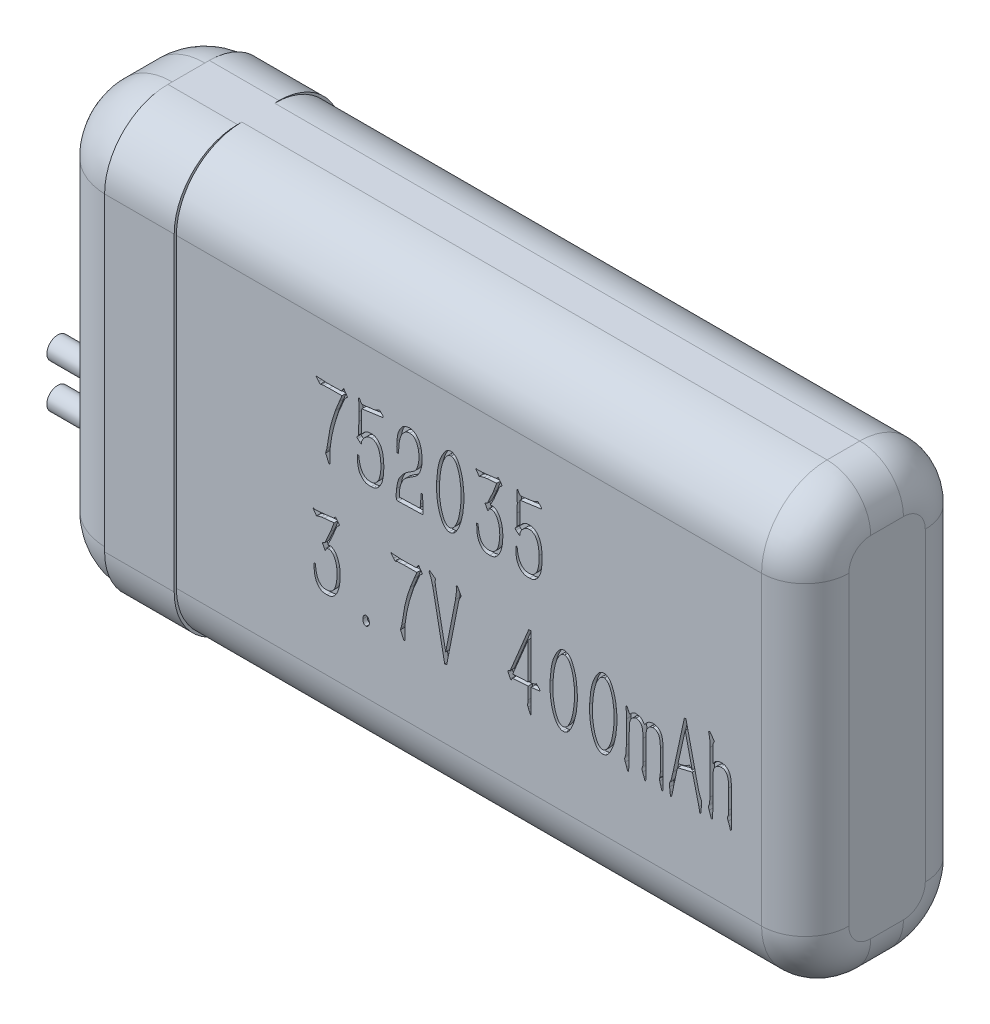
from build123d import *

# Parameters (mm, degrees)
SKETCH_1_W           = 35
SKETCH_1_H           = 20
EXTRUDE_1_DEPTH      = 7.5
FILLET_1_R           = 3
FILLET_2_R           = 2
FILLET_3_R           = 3
EXTRUDE_2_DEPTH      = 0.1
EXTRUDE_2_DEPTH_BACK = 7.6
SKETCH_2_W           = 3.188879143
SKETCH_2_H           = 20
FILLET_5_R           = 2.9
SKETCH_3_R           = 0.5
EXTRUDE_3_DEPTH      = 3
SKETCH_4_R           = 0.5
EXTRUDE_4_DEPTH      = 3
CUT_EXTRUDE_1_DEPTH  = 0.2


with BuildPart() as part:
    # 草图1 → 凸台-拉伸1 (new body)
    with BuildSketch(Plane.XY):
        with Locations((10.324980293, 6.419787979)):
            Rectangle(SKETCH_1_W, SKETCH_1_H)
    extrude(amount=EXTRUDE_1_DEPTH)

    # 圆角1
    fillet_1_edges = [part.edges().sort_by_distance(p)[0] for p in [
        (10.324980293, 16.419787979, 7.5),
        (10.324980293, 16.419787979, 0),
        (10.324980293, -3.580212021, 0),
        (10.324980293, -3.580212021, 7.5),
    ]]
    fillet(fillet_1_edges, radius=FILLET_1_R)

    # 圆角2
    fillet_2_edges = [part.edges().sort_by_distance(p)[0] for p in [
        (27.824980293, 16.419787979, 3.75),
        (27.824980293, 6.419787979, 0),
        (27.824980293, 6.419787979, 7.5),
        (27.824980293, -3.580212021, 3.75),
        (27.824980293, -2.701532364, 6.621320344),
        (27.824980293, -2.701532364, 0.878679656),
        (27.824980293, 15.541108323, 6.621320344),
        (27.824980293, 15.541108323, 0.878679656),
    ]]
    fillet(fillet_2_edges, radius=FILLET_2_R)

    # 圆角3
    fillet_3_edges = [part.edges().sort_by_distance(p)[0] for p in [
        (-7.175019707, 16.419787979, 3.75),
        (-7.175019707, 6.419787979, 0),
        (-7.175019707, -3.580212021, 3.75),
        (-7.175019707, 6.419787979, 7.5),
        (-7.175019707, -2.701532364, 6.621320344),
        (-7.175019707, -2.701532364, 0.878679656),
        (-7.175019707, 15.541108323, 6.621320344),
        (-7.175019707, 15.541108323, 0.878679656),
    ]]
    fillet(fillet_3_edges, radius=FILLET_3_R)

    # 草图2 → 凸台-拉伸2 (add, two sides: drawn at the far end of the back side and taken through both)
    with BuildSketch(Plane.XY.offset(7.5).offset(-EXTRUDE_2_DEPTH_BACK)):
        with Locations((-2.580580136, 6.419787979)):
            Rectangle(SKETCH_2_W, SKETCH_2_H)
    extrude(amount=EXTRUDE_2_DEPTH + EXTRUDE_2_DEPTH_BACK)

    # 圆角5
    fillet_5_edges = [part.edges().sort_by_distance(p)[0] for p in [
        (-2.580580135, -3.580212021, -0.1),
        (-2.580580135, 16.419787979, -0.1),
        (-2.580580135, -3.580212021, 7.6),
        (-2.580580135, 16.419787979, 7.6),
    ]]
    fillet(fillet_5_edges, radius=FILLET_5_R)

    # 草图3 → 凸台-拉伸3 (add)
    with BuildSketch(Plane.ZY.offset(7.175019707)):
        with Locations(Location((3.75, 0.501994532, 0), (0, 0, 90))):
            Circle(SKETCH_3_R)
    extrude(amount=EXTRUDE_3_DEPTH)

    # 草图4 → 凸台-拉伸4 (add)
    with BuildSketch(Plane.ZY.offset(7.175019707)):
        with Locations(Location((3.744779224, 2.501994532, 0), (0, 0, 90))):
            Circle(SKETCH_4_R)
    extrude(amount=EXTRUDE_4_DEPTH)

    # 草图5 → 切除-拉伸1 (cut)
    # profile 1 of 16: a face of its own
    with BuildSketch(Plane.XY.offset(7.5)):
        with BuildLine():
            add(Edge.make_bspline(
                [(6.59952291, 10.853199862), (6.563974082, 10.853725603), (6.495861779, 10.854732935), (6.398657937, 10.855721733), (6.310899351, 10.854982482), (6.233089905, 10.856762989), (6.164977039, 10.855108701), (6.106553578, 10.855641985), (6.057813442, 10.855010457), (6.028493325, 10.853753825), (6.015568084, 10.853199862)],
                knots=[0, 0, 0, 0, 1.461051911, 2.799406174, 3.994695385, 5.067439477, 5.997164994, 6.794024468, 7.468367567, 8, 8, 8, 8], degree=3))
            Line((6.015568084, 10.853199862), (5.773931604, 10.843504571))
            add(Edge.make_bspline(
                [(5.773931604, 10.843504571), (5.756165867, 10.843645186), (5.725601276, 10.843887103), (5.696060819, 10.836258112), (5.68369082, 10.833063489)],
                knots=[0, 0, 0, 0, 1.16250452, 2, 2, 2, 2], degree=3))
            Line((5.68369082, 10.833063489), (5.632976991, 10.812927115))
            add(Edge.make_bspline(
                [(5.632976991, 10.812927115), (5.627247987, 10.811680286), (5.617255191, 10.809505508), (5.607365238, 10.811903797), (5.603145326, 10.812927115)],
                knots=[0, 0, 0, 0, 1.146626707, 2, 2, 2, 2], degree=3))
            add(Edge.make_bspline(
                [(5.603145326, 10.812927115), (5.599039112, 10.814986497), (5.588446185, 10.820299149), (5.573456349, 10.836861967), (5.553168833, 10.8593559), (5.539783404, 10.878364038), (5.532295124, 10.888997859)],
                knots=[0, 0, 0, 0, 0.522008364, 1.346640983, 2.515617707, 4, 4, 4, 4], degree=3))
            Line((5.532295124, 10.888997859), (5.427138508, 11.009816099))
            add(Edge.make_bspline(
                [(5.427138508, 11.009816099), (5.423147991, 11.015251114), (5.417040136, 11.023569909), (5.409578861, 11.036349933), (5.415984839, 11.046509909), (5.4228079, 11.04869926), (5.427138508, 11.050088845)],
                knots=[0, 0, 0, 0, 1.576958087, 2.413680609, 2.993160347, 4, 4, 4, 4], degree=3))
            Line((5.427138508, 11.050088845), (5.527820374, 11.039647763))
            Line((5.527820374, 11.039647763), (5.703827193, 11.029952472))
            add(Edge.make_bspline(
                [(5.703827193, 11.029952472), (5.745329966, 11.026985742), (5.824059819, 11.021357919), (5.936219177, 11.016918873), (6.035738698, 11.015575475), (6.097858633, 11.018263683), (6.126691033, 11.01951139)],
                knots=[0, 0, 0, 0, 1.17952993, 2.237542501, 3.181971475, 4, 4, 4, 4], degree=3))
            Line((6.126691033, 11.01951139), (6.574911787, 11.029952472))
            Line((6.574911787, 11.029952472), (6.680068403, 11.180602376))
            Line((6.680068403, 11.180602376), (6.856821014, 10.924050064))
            Line((6.856821014, 10.924050064), (6.736002774, 10.812927115))
            add(Edge.make_bspline(
                [(6.736002774, 10.812927115), (6.730619208, 10.799715406), (6.72073935, 10.775469425), (6.705921525, 10.742533938), (6.695299375, 10.71509729), (6.686591788, 10.695065806), (6.679301116, 10.678445504), (6.671858594, 10.661285353), (6.661922042, 10.638411748), (6.649617474, 10.609655814), (6.633576139, 10.575740126), (6.616690988, 10.535625297), (6.596411212, 10.490193961), (6.566217015, 10.423345676), (6.529272822, 10.339084413), (6.489529605, 10.241200182), (6.452508011, 10.151342234), (6.41002177, 10.038785767), (6.361829485, 9.896092852), (6.30545109, 9.715675074), (6.25055084, 9.518009006), (6.194431145, 9.3046854), (6.144485533, 9.078096787), (6.10899684, 8.884806375), (6.08635037, 8.730826378), (6.071787719, 8.619994003), (6.061828297, 8.513964958), (6.053240404, 8.413810491), (6.048245491, 8.320280832), (6.045157898, 8.234503435), (6.04412672, 8.156904502), (6.045498082, 8.107939256), (6.046145539, 8.084821426)],
                knots=[0, 0, 0, 0, 0.452499367, 0.830421745, 1.145244612, 1.385457386, 1.523169464, 1.720933553, 1.978750205, 2.31422616, 2.712964021, 3.168544679, 3.694564508, 4.291044716, 5.495236599, 6.612541028, 7.641936826, 8.577774526, 10.428066285, 12.41833758, 14.572718391, 16.934712686, 19.414194725, 21.930665941, 23.166281125, 24.350715242, 25.475866727, 26.54391973, 27.539008514, 28.446374518, 29.266490973, 30, 30, 30, 30], degree=3))
            Line((6.046145539, 8.084821426), (6.046145539, 7.868541861))
            Line((6.046145539, 7.868541861), (6.011093334, 7.848405487))
            Line((6.011093334, 7.848405487), (5.850002347, 8.205639666))
            add(Edge.make_bspline(
                [(5.850002347, 8.205639666), (5.853089639, 8.215305494), (5.858526072, 8.232326114), (5.864336177, 8.254816732), (5.868282286, 8.270195238), (5.869666442, 8.278224877), (5.870138721, 8.280964618)],
                knots=[0, 0, 0, 0, 1.560097851, 2.74718673, 3.572535822, 4, 4, 4, 4], degree=3))
            Line((5.870138721, 8.280964618), (5.910411467, 8.421919231))
            add(Edge.make_bspline(
                [(5.910411467, 8.421919231), (5.915656413, 8.451746555), (5.926839791, 8.515344966), (5.944118342, 8.616714403), (5.961848456, 8.730393673), (5.980272601, 8.851533181), (5.999178684, 8.970817949), (6.015770488, 9.078595836), (6.031805529, 9.169728626), (6.04572481, 9.249971618), (6.062666539, 9.330361534), (6.08528795, 9.421507477), (6.113876015, 9.529092445), (6.146807324, 9.649110167), (6.184122461, 9.77319228), (6.220704819, 9.894159717), (6.258989533, 10.006563267), (6.28494917, 10.078606481), (6.29747731, 10.11337459)],
                knots=[0, 0, 0, 0, 0.835904569, 1.782332284, 2.838215692, 4.011468279, 5.164379694, 6.171749793, 7.021175418, 7.718362152, 8.4194883, 9.288205322, 10.310099412, 11.492047838, 12.723030323, 13.886349048, 14.979950486, 16, 16, 16, 16], degree=3))
            Line((6.29747731, 10.11337459), (6.47870467, 10.561595345))
            Line((6.47870467, 10.561595345), (6.59952291, 10.853199862))
        make_face()
    # profile 2 of 16: a face of its own
    with BuildSketch(Plane.XY.offset(7.5)):
        with BuildLine():
            add(Edge.make_bspline(
                [(7.517592375, 10.969543352), (7.529318908, 10.970779929), (7.549636664, 10.97292246), (7.569571983, 10.977361588), (7.578001495, 10.979238643)],
                knots=[0, 0, 0, 0, 1.154313806, 2, 2, 2, 2], degree=3))
            Line((7.578001495, 10.979238643), (7.683903903, 10.984459184))
            Line((7.683903903, 10.984459184), (7.880047095, 11.014290848))
            Line((7.880047095, 11.014290848), (8.046358623, 11.034427222))
            add(Edge.make_bspline(
                [(8.046358623, 11.034427222), (8.061895263, 11.036939018), (8.0945479, 11.042217944), (8.125562555, 11.053742924), (8.141819948, 11.059784136)],
                knots=[0, 0, 0, 0, 0.951631555, 2, 2, 2, 2], degree=3))
            Line((8.141819948, 11.059784136), (8.2171449, 11.090361592))
            add(Edge.make_bspline(
                [(8.2171449, 11.090361592), (8.22489551, 11.093237854), (8.238493751, 11.098284179), (8.25584302, 11.106219687), (8.268335934, 11.111293393), (8.275067339, 11.113980177), (8.27755402, 11.114972715)],
                knots=[0, 0, 0, 0, 1.520021181, 2.666837392, 3.507509911, 4, 4, 4, 4], degree=3))
            Line((8.27755402, 11.114972715), (8.323047308, 11.145550171))
            Line((8.323047308, 11.145550171), (8.469222463, 10.999375016))
            add(Edge.make_bspline(
                [(8.469222463, 10.999375016), (8.474700419, 10.992057132), (8.48429064, 10.979245762), (8.487841681, 10.957304473), (8.483158965, 10.941360929), (8.477817444, 10.927329125), (8.462726855, 10.918875791), (8.450929653, 10.918846852), (8.443865548, 10.918829523)],
                knots=[0, 0, 0, 0, 1.452844315, 2.54348448, 3.406058373, 4.120848162, 4.874773518, 6, 6, 6, 6], degree=3))
            Line((8.443865548, 10.918829523), (7.507151293, 10.788315992))
            Line((7.507151293, 10.788315992), (7.492235461, 9.765835703))
            add(Edge.make_bspline(
                [(7.492235461, 9.765835703), (7.511297303, 9.78901317), (7.546459394, 9.831767076), (7.598718401, 9.893005639), (7.65945008, 9.945028454), (7.721795158, 9.978618913), (7.780252068, 10.002446238), (7.832045854, 10.014575506), (7.8892616, 10.02220472), (7.92924136, 10.02281475), (7.950151506, 10.023133806)],
                knots=[0, 0, 0, 0, 1.30943776, 2.415431215, 3.508265892, 4.775479805, 5.486396256, 6.257089544, 7.088425914, 8, 8, 8, 8], degree=3))
            add(Edge.make_bspline(
                [(7.950151506, 10.023133806), (7.970830482, 10.021793835), (8.009917781, 10.019261029), (8.064416765, 10.00962861), (8.111738874, 9.996065096), (8.165742594, 9.968267993), (8.228840564, 9.92013825), (8.288322387, 9.861306922), (8.334619836, 9.804300441), (8.368753543, 9.755317374), (8.397132282, 9.699284503), (8.424206598, 9.638966353), (8.44832617, 9.572793703), (8.468239966, 9.500187964), (8.484521285, 9.421196047), (8.501249337, 9.304877377), (8.516037508, 9.14743478), (8.518110211, 9.018096402), (8.5191905, 8.950685479)],
                knots=[0, 0, 0, 0, 0.737858689, 1.39469691, 1.969129469, 2.484137971, 3.548991738, 4.782985237, 5.456749125, 6.164369648, 6.905359031, 7.690566505, 8.520047268, 9.411980184, 10.370982938, 11.392008999, 13.598323608, 16, 16, 16, 16], degree=3))
            add(Edge.make_bspline(
                [(8.5191905, 8.950685479), (8.517984371, 8.920604449), (8.515651233, 8.862415632), (8.511668633, 8.778062577), (8.504774023, 8.699748585), (8.494160805, 8.605575077), (8.477716933, 8.497696634), (8.448840614, 8.378050682), (8.40906961, 8.267802813), (8.355943766, 8.168525916), (8.295832913, 8.081811871), (8.231498179, 8.012512569), (8.165095241, 7.962115142), (8.09434927, 7.930368383), (8.017113026, 7.916186526), (7.963622932, 7.914293819), (7.935235674, 7.913289357)],
                knots=[0, 0, 0, 0, 0.953497838, 1.844448518, 2.674189816, 3.442807412, 4.845957472, 6.127295929, 7.335424679, 8.547012004, 9.682888764, 10.668703604, 11.530079681, 12.305522429, 13.100738679, 14, 14, 14, 14], degree=3))
            add(Edge.make_bspline(
                [(7.935235674, 7.913289357), (7.901174313, 7.912700606), (7.838000402, 7.911608645), (7.74720103, 7.922465525), (7.664834227, 7.952272996), (7.586500083, 7.997792813), (7.51330251, 8.061918385), (7.450262655, 8.140462749), (7.39995989, 8.225368242), (7.363523242, 8.313968266), (7.341226086, 8.409623207), (7.32221005, 8.513772953), (7.309463789, 8.623983543), (7.310503572, 8.698330796), (7.311008101, 8.734405913)],
                knots=[0, 0, 0, 0, 1.038316962, 1.925775792, 2.769505923, 3.689817589, 4.672983852, 5.718137725, 6.747565775, 7.672204827, 8.626195073, 9.735182009, 10.901054531, 12, 12, 12, 12], degree=3))
            Line((7.311008101, 8.734405913), (7.316228642, 8.875360527))
            Line((7.316228642, 8.875360527), (7.371417221, 8.875360527))
            add(Edge.make_bspline(
                [(7.371417221, 8.875360527), (7.373714704, 8.847253318), (7.378257941, 8.79167177), (7.388413846, 8.708377483), (7.404926932, 8.62384333), (7.425048734, 8.538316271), (7.451514806, 8.457631668), (7.479702025, 8.383170439), (7.520011263, 8.315403575), (7.569004295, 8.247623674), (7.632075781, 8.185060495), (7.694918653, 8.141712985), (7.752404805, 8.116977454), (7.801526177, 8.103411661), (7.856481915, 8.096459408), (7.894945786, 8.095184643), (7.9150993, 8.094516717)],
                knots=[0, 0, 0, 0, 1.11825376, 2.211328589, 3.324923754, 4.532299777, 5.691974021, 6.691431964, 7.680579644, 8.808308283, 10.000254076, 11.186807161, 11.80939407, 12.474247533, 13.200567339, 14, 14, 14, 14], degree=3))
            add(Edge.make_bspline(
                [(7.9150993, 8.094516717), (7.938779912, 8.094613851), (7.986561719, 8.094809846), (8.046602733, 8.109059678), (8.093874053, 8.131528466), (8.130511982, 8.157871541), (8.16878348, 8.191347654), (8.205740711, 8.233791782), (8.241757351, 8.280989063), (8.273506019, 8.332732422), (8.298889502, 8.3884477), (8.325650749, 8.468674566), (8.350514062, 8.57735012), (8.373309545, 8.717258753), (8.385180714, 8.870188264), (8.384044838, 8.976275342), (8.383456428, 9.031230972)],
                knots=[0, 0, 0, 0, 0.849390509, 1.713866746, 2.18933602, 2.722107664, 3.329685584, 4.012931591, 4.740083059, 5.461671267, 6.189151886, 6.934940173, 8.497098365, 10.188936476, 12.025778447, 14, 14, 14, 14], degree=3))
            add(Edge.make_bspline(
                [(8.383456428, 9.031230972), (8.381783532, 9.063325244), (8.378588322, 9.12462487), (8.36905484, 9.21207879), (8.359285657, 9.29081644), (8.342409865, 9.382880542), (8.315036761, 9.488172685), (8.275846107, 9.585854576), (8.237920744, 9.656379598), (8.206839699, 9.703167172), (8.171300536, 9.743133854), (8.132564216, 9.776943013), (8.090516494, 9.803896204), (8.046231694, 9.824450529), (7.999061728, 9.837482586), (7.966636306, 9.840415419), (7.950151506, 9.841906446)],
                knots=[0, 0, 0, 0, 1.343436322, 2.565945237, 3.677305729, 4.659990038, 6.477828082, 8.216935171, 9.044830502, 9.823221578, 10.559528994, 11.274319052, 11.966299338, 12.640726254, 13.308957145, 14, 14, 14, 14], degree=3))
            add(Edge.make_bspline(
                [(7.950151506, 9.841906446), (7.932216399, 9.841357507), (7.89735221, 9.840290419), (7.846574633, 9.831275761), (7.799535165, 9.81549939), (7.743218164, 9.787820494), (7.681512292, 9.746985719), (7.621540849, 9.691049952), (7.574572633, 9.634380547), (7.553061509, 9.593929015), (7.54294929, 9.574913052)],
                knots=[0, 0, 0, 0, 0.840347904, 1.633558669, 2.40744423, 3.157989381, 4.570423979, 5.856859538, 6.992525654, 8, 8, 8, 8], degree=3))
            Line((7.54294929, 9.574913052), (7.507151293, 9.504062849))
            Line((7.507151293, 9.504062849), (7.497456002, 9.43917898))
            add(Edge.make_bspline(
                [(7.497456002, 9.43917898), (7.496882883, 9.430266936), (7.495876735, 9.414621247), (7.49248464, 9.393778805), (7.49042499, 9.380931509), (7.488680922, 9.369298871), (7.477174299, 9.37071109), (7.466011398, 9.381171885), (7.446084459, 9.397244177), (7.430979393, 9.410990309), (7.42213105, 9.419042606)],
                knots=[0, 0, 0, 0, 1.417361355, 2.488272572, 3.242975776, 3.665551287, 3.979432497, 4.77388376, 6.110184861, 8, 8, 8, 8], degree=3))
            Line((7.42213105, 9.419042606), (7.316228642, 9.504062849))
            add(Edge.make_bspline(
                [(7.316228642, 9.504062849), (7.307151669, 9.512318563), (7.293061465, 9.525133924), (7.277581226, 9.549406929), (7.289099434, 9.575047999), (7.299335343, 9.590518267), (7.305787559, 9.600269966)],
                knots=[0, 0, 0, 0, 1.303116375, 2.022830373, 2.753688992, 4, 4, 4, 4], degree=3))
            Line((7.305787559, 9.600269966), (7.36172193, 9.675594918))
            Line((7.36172193, 9.675594918), (7.371417221, 10.214056457))
            Line((7.371417221, 10.214056457), (7.376637762, 10.601868091))
            add(Edge.make_bspline(
                [(7.376637762, 10.601868091), (7.376638344, 10.61628674), (7.376639599, 10.647361414), (7.376628624, 10.697080644), (7.376678191, 10.753015966), (7.37647213, 10.812178144), (7.377185481, 10.869128128), (7.375161506, 10.917583406), (7.37424112, 10.954928827), (7.372248746, 10.975763675), (7.371417221, 10.984459184)],
                knots=[0, 0, 0, 0, 0.904131945, 1.948560225, 3.117696361, 4.41154035, 5.658618894, 6.687930963, 7.452402571, 8, 8, 8, 8], degree=3))
            Line((7.371417221, 10.984459184), (7.351280847, 11.14032963))
            Line((7.351280847, 11.14032963), (7.401994676, 11.160466003))
            add(Edge.make_bspline(
                [(7.401994676, 11.160466003), (7.409381259, 11.14181159), (7.421800563, 11.11044731), (7.439240294, 11.068559224), (7.461226427, 11.037069827), (7.478056393, 11.019283625), (7.487014919, 11.009816099)],
                knots=[0, 0, 0, 0, 1.37928148, 2.31903137, 3.105226912, 4, 4, 4, 4], degree=3))
            Line((7.487014919, 11.009816099), (7.517592375, 10.969543352))
        make_face()
    # profile 3 of 16: a face of its own
    with BuildSketch(Plane.XY.offset(7.5)):
        with BuildLine():
            Line((9.195623485, 9.851601737), (9.119552742, 9.851601737))
            add(Edge.make_bspline(
                [(9.119552742, 9.851601737), (9.117985338, 9.875710992), (9.114997206, 9.921673378), (9.111913863, 9.987312652), (9.110611751, 10.046248696), (9.109307334, 10.118098639), (9.111319073, 10.208710499), (9.116720761, 10.281694848), (9.119552742, 10.319958865)],
                knots=[0, 0, 0, 0, 0.927540379, 1.768282303, 2.522502339, 3.190652681, 4.527123766, 6, 6, 6, 6], degree=3))
            add(Edge.make_bspline(
                [(9.119552742, 10.319958865), (9.121512649, 10.348325142), (9.125302885, 10.403182272), (9.135305889, 10.482244778), (9.146882396, 10.555509153), (9.161932951, 10.624419708), (9.182268731, 10.691855568), (9.211218914, 10.759684423), (9.247325246, 10.830229487), (9.289983917, 10.901021433), (9.336790555, 10.967819315), (9.389329063, 11.022176564), (9.444314883, 11.063607761), (9.502818491, 11.088265637), (9.558990429, 11.103599318), (9.610214635, 11.115660893), (9.656246214, 11.124090303), (9.685328945, 11.124989903), (9.699032818, 11.125413798)],
                knots=[0, 0, 0, 0, 1.238521709, 2.395159043, 3.470603583, 4.46912877, 5.466066804, 6.534123646, 7.677244524, 8.916145015, 10.13365226, 11.221244199, 12.198275335, 13.109907183, 13.966820176, 14.733954848, 15.403435577, 16, 16, 16, 16], degree=3))
            add(Edge.make_bspline(
                [(9.699032818, 11.125413798), (9.716497014, 11.124126116), (9.751005723, 11.121581696), (9.80176708, 11.109792701), (9.850792131, 11.092794731), (9.913496826, 11.06251471), (9.986819873, 11.015039813), (10.049198252, 10.952697409), (10.092362319, 10.895631093), (10.122767171, 10.847063245), (10.149710669, 10.79283049), (10.183546772, 10.714028451), (10.218944041, 10.609457428), (10.244470743, 10.477383502), (10.260837834, 10.340230609), (10.2683263, 10.200019048), (10.2697187, 10.061189432), (10.261566966, 9.970647007), (10.25763073, 9.926926689)],
                knots=[0, 0, 0, 0, 0.570779476, 1.127842599, 1.694919432, 2.261066821, 3.397481896, 4.527710891, 5.118384485, 5.730727279, 6.394748858, 7.092559246, 8.529363642, 9.986910621, 11.474321506, 13.03467297, 14.568129345, 16, 16, 16, 16], degree=3))
            add(Edge.make_bspline(
                [(10.25763073, 9.926926689), (10.249651355, 9.881954441), (10.233573553, 9.791338953), (10.198943867, 9.682239154), (10.166647758, 9.599295191), (10.139646517, 9.543714286), (10.110795957, 9.494509698), (10.06907822, 9.436320398), (10.005369787, 9.370269038), (9.946333529, 9.32597423), (9.915312384, 9.302699116)],
                knots=[0, 0, 0, 0, 1.490916612, 3.004077927, 3.729534125, 4.397912905, 5.020560084, 5.590839424, 6.734084393, 8, 8, 8, 8], degree=3))
            Line((9.915312384, 9.302699116), (9.668455363, 9.146828671))
            add(Edge.make_bspline(
                [(9.668455363, 9.146828671), (9.636998358, 9.125472906), (9.577349875, 9.084978301), (9.497702683, 9.018832267), (9.430852182, 8.949136183), (9.380323088, 8.872072934), (9.341078176, 8.792747136), (9.306229944, 8.713096278), (9.2799213, 8.625302701), (9.261209569, 8.546610847), (9.248448788, 8.480521528), (9.242056658, 8.434429428), (9.236863917, 8.393692665), (9.236205303, 8.368235846), (9.235896232, 8.35628957)],
                knots=[0, 0, 0, 0, 1.453572249, 2.75625039, 3.953730064, 5.132566341, 6.263730064, 7.337486329, 8.453238547, 9.76321854, 10.430854957, 11.026567013, 11.543191201, 12, 12, 12, 12], degree=3))
            Line((9.235896232, 8.35628957), (9.22545515, 8.145230546))
            Line((9.22545515, 8.145230546), (10.126371408, 8.17506221))
            add(Edge.make_bspline(
                [(10.126371408, 8.17506221), (10.137931686, 8.175708575), (10.158236127, 8.176843848), (10.177749941, 8.198117234), (10.182093491, 8.224092055), (10.189800849, 8.256040337), (10.195530742, 8.301835348), (10.199950954, 8.336661702), (10.202442151, 8.35628957)],
                knots=[0, 0, 0, 0, 0.925905201, 1.626257371, 2.181371879, 3.087088273, 4.358305093, 6, 6, 6, 6], degree=3))
            Line((10.202442151, 8.35628957), (10.222578525, 8.794815033))
            Line((10.222578525, 8.794815033), (10.292682936, 8.794815033))
            Line((10.292682936, 8.794815033), (10.31803985, 8.130314714))
            add(Edge.make_bspline(
                [(10.31803985, 8.130314714), (10.318887545, 8.117396103), (10.320370165, 8.09480144), (10.321091885, 8.064911967), (10.321112313, 8.044099445), (10.320797544, 8.027295444), (10.315385354, 8.01260339), (10.310356341, 7.995555771), (10.290738633, 7.985924669), (10.26253957, 7.98284314), (10.219683265, 7.978478865), (10.186047417, 7.978757997), (10.166644154, 7.978919018)],
                knots=[0, 0, 0, 0, 1.385018147, 2.4223982, 3.193529914, 3.619812046, 4.200562765, 4.878496499, 5.402948042, 6.404258339, 7.925751149, 10, 10, 10, 10], degree=3))
            Line((10.166644154, 7.978919018), (9.16504603, 7.953562104))
            add(Edge.make_bspline(
                [(9.16504603, 7.953562104), (9.15287059, 7.953526485), (9.1288719, 7.953456277), (9.104278907, 7.977320252), (9.093955275, 8.006534396), (9.088788338, 8.040896091), (9.085327401, 8.086482684), (9.08366498, 8.164888822), (9.087219183, 8.276448709), (9.095224923, 8.368503134), (9.099416368, 8.41669869)],
                knots=[0, 0, 0, 0, 0.556373901, 1.096654043, 1.476064089, 2.012759395, 2.73145082, 3.635924119, 5.715166189, 8, 8, 8, 8], degree=3))
            add(Edge.make_bspline(
                [(9.099416368, 8.41669869), (9.103135928, 8.444830371), (9.110301092, 8.499021755), (9.124869547, 8.577027484), (9.140401882, 8.649434263), (9.157258566, 8.716198286), (9.175867515, 8.776967823), (9.196179131, 8.831673306), (9.217235252, 8.88119579), (9.248862637, 8.937218679), (9.289058581, 8.998285514), (9.33477926, 9.064130262), (9.37879937, 9.119984291), (9.4363358, 9.181432726), (9.51422911, 9.248504305), (9.579664445, 9.297615777), (9.613266784, 9.322835489)],
                knots=[0, 0, 0, 0, 1.103491021, 2.125706759, 3.085324024, 3.98349739, 4.803138144, 5.555704107, 6.252741852, 6.89323317, 8.054555834, 9.09539633, 10.010480884, 10.817709087, 12.365830683, 14, 14, 14, 14], degree=3))
            Line((9.613266784, 9.322835489), (9.819851058, 9.454094812))
            add(Edge.make_bspline(
                [(9.819851058, 9.454094812), (9.83639034, 9.465091131), (9.868129018, 9.486192933), (9.911966873, 9.519788714), (9.949340288, 9.554646725), (9.98154748, 9.592263072), (10.010703034, 9.635790521), (10.034647343, 9.690046802), (10.059960821, 9.753955479), (10.089474932, 9.853385438), (10.119906112, 9.984624241), (10.131571728, 10.146774953), (10.125339851, 10.311028548), (10.106287827, 10.420048562), (10.096539744, 10.47582931)],
                knots=[0, 0, 0, 0, 0.635613896, 1.219735276, 1.765761318, 2.268061313, 2.802129131, 3.435697723, 4.161225462, 5.001884758, 6.75303811, 8.46119913, 10.189351173, 12, 12, 12, 12], degree=3))
            add(Edge.make_bspline(
                [(10.096539744, 10.47582931), (10.089194398, 10.504266311), (10.074868534, 10.559727905), (10.047753794, 10.639622493), (10.012655424, 10.712388563), (9.975087907, 10.780363248), (9.92802291, 10.839864582), (9.865331625, 10.882598376), (9.791270377, 10.911164932), (9.737096441, 10.916195337), (9.708728109, 10.918829523)],
                knots=[0, 0, 0, 0, 1.101106684, 2.147523679, 3.156537618, 4.125318695, 5.058520457, 5.968677808, 6.93629249, 8, 8, 8, 8], degree=3))
            add(Edge.make_bspline(
                [(9.708728109, 10.918829523), (9.693795713, 10.9189824), (9.664012003, 10.919287323), (9.619650481, 10.912560021), (9.576502789, 10.898454704), (9.519824372, 10.872889597), (9.454331323, 10.825268723), (9.385394961, 10.753417848), (9.328533424, 10.665686366), (9.284754396, 10.56402158), (9.251835826, 10.448197674), (9.225112392, 10.318390541), (9.207565014, 10.17295407), (9.202662577, 10.071159468), (9.200098235, 10.017913265)],
                knots=[0, 0, 0, 0, 0.469335518, 0.936122588, 1.403629858, 1.893624907, 2.887406355, 3.927357629, 5.011993806, 6.157121359, 7.396943717, 8.794309501, 10.323183677, 12, 12, 12, 12], degree=3))
            Line((9.200098235, 10.017913265), (9.195623485, 9.851601737))
        make_face()
    # profile 4 of 16: a face of its own
    with BuildSketch(Plane.XY.offset(7.5)):
        with BuildLine():
            add(Edge.make_bspline(
                [(10.933317924, 9.580133593), (10.935748315, 9.628380581), (10.940727732, 9.72722962), (10.954264216, 9.878741845), (10.974230972, 10.036804238), (10.997384796, 10.199131214), (11.02942345, 10.359487563), (11.07042693, 10.51198512), (11.122771146, 10.652982285), (11.175002484, 10.761250051), (11.219156484, 10.840630634), (11.251282735, 10.893436508), (11.281846388, 10.94105841), (11.3119586, 10.982433031), (11.341513835, 11.017664484), (11.368771261, 11.048213141), (11.396280052, 11.071996739), (11.430780061, 11.095580357), (11.472774005, 11.116614443), (11.521437132, 11.135015441), (11.568261699, 11.145659833), (11.598765597, 11.145585856), (11.613479867, 11.145550171)],
                knots=[0, 0, 0, 0, 1.583211401, 3.243703523, 4.983978234, 6.804605119, 8.6166428, 10.340282122, 11.974804003, 13.53820457, 14.274983449, 14.951299633, 15.563740824, 16.129235462, 16.626851747, 17.070813204, 17.469389546, 17.815167281, 18.438300608, 19.002855301, 19.519003895, 20, 20, 20, 20], degree=3))
            add(Edge.make_bspline(
                [(11.613479867, 11.145550171), (11.627550053, 11.143089837), (11.657268477, 11.137893229), (11.701204434, 11.11857123), (11.747836123, 11.092875138), (11.797449801, 11.059570723), (11.846984337, 11.014791133), (11.892891029, 10.95548186), (11.93550967, 10.883048514), (11.988472272, 10.768411573), (12.046835268, 10.613028999), (12.092661602, 10.44987953), (12.12242896, 10.313657314), (12.141842041, 10.204973998), (12.157278547, 10.089726317), (12.173854907, 9.927710489), (12.188637973, 9.720102915), (12.191020551, 9.552816323), (12.192214152, 9.469010644)],
                knots=[0, 0, 0, 0, 0.36369769, 0.768186139, 1.217229854, 1.724510149, 2.290946358, 2.914777825, 3.632489608, 4.433551378, 6.137860108, 7.866765886, 8.757390638, 9.699141408, 10.686159515, 11.726895222, 13.859299765, 16, 16, 16, 16], degree=3))
            add(Edge.make_bspline(
                [(12.192214152, 9.469010644), (12.18764861, 9.401858072), (12.178265467, 9.263845528), (12.155943512, 9.052473765), (12.119128491, 8.832581758), (12.072801454, 8.647354457), (12.027991682, 8.499873898), (11.989991446, 8.393453308), (11.947473376, 8.292954295), (11.90209338, 8.199350813), (11.854884025, 8.11602659), (11.806015213, 8.046010112), (11.754375682, 7.992083338), (11.70132284, 7.953347705), (11.649523553, 7.927097133), (11.600029586, 7.910312883), (11.552896304, 7.900996379), (11.522273261, 7.902751699), (11.507577459, 7.903594066)],
                knots=[0, 0, 0, 0, 1.760488992, 3.618172134, 5.557361062, 7.587083219, 8.607294374, 9.588398617, 10.541277716, 11.460251193, 12.307925722, 13.044175775, 13.687957546, 14.251129358, 14.754223989, 15.200440537, 15.616296545, 16, 16, 16, 16], degree=3))
            add(Edge.make_bspline(
                [(11.507577459, 7.903594066), (11.493535211, 7.905567921), (11.463949279, 7.909726681), (11.419352897, 7.927227234), (11.37291167, 7.954190874), (11.323332465, 7.989734492), (11.273408945, 8.038566097), (11.225335538, 8.101726411), (11.179233784, 8.17955863), (11.135421849, 8.270577962), (11.094271757, 8.371958003), (11.058239663, 8.481348633), (11.024856644, 8.596299983), (10.998107856, 8.716487661), (10.976096433, 8.837956674), (10.958825862, 8.957355204), (10.946707793, 9.073286439), (10.940167988, 9.185287991), (10.937881189, 9.292503692), (10.935464367, 9.393927222), (10.93395243, 9.48914303), (10.933524219, 9.550550127), (10.933317924, 9.580133593)],
                knots=[0, 0, 0, 0, 0.451175502, 0.950591959, 1.515271951, 2.162531354, 2.891688268, 3.734081857, 4.687580886, 5.773002708, 6.954198864, 8.17563603, 9.445923076, 10.771603705, 12.101713585, 13.383756751, 14.619631726, 15.819374781, 16.961914306, 18.040825747, 19.056148764, 20, 20, 20, 20], degree=3))
        make_face()
        with BuildLine():
            add(Edge.make_bspline(
                [(11.064577246, 9.569692511), (11.064046501, 9.545579694), (11.062919454, 9.494375649), (11.061847596, 9.412822568), (11.063847219, 9.322075981), (11.067263917, 9.18816543), (11.079807932, 9.013161144), (11.11186815, 8.803060428), (11.157656274, 8.599594576), (11.208110652, 8.440155293), (11.255083289, 8.326497076), (11.29112808, 8.25595669), (11.329048505, 8.198969678), (11.368777622, 8.155562208), (11.408964612, 8.124800026), (11.446520839, 8.102818026), (11.482110036, 8.087723558), (11.505961354, 8.085755005), (11.51727275, 8.084821426)],
                knots=[0, 0, 0, 0, 0.705717407, 1.498604912, 2.386138873, 3.361274458, 5.418191474, 7.514713171, 9.57394393, 11.515405308, 12.398906158, 13.169972934, 13.829695216, 14.395845116, 14.883250105, 15.303691084, 15.669778158, 16, 16, 16, 16], degree=3))
            add(Edge.make_bspline(
                [(11.51727275, 8.084821426), (11.527744563, 8.084956113), (11.550237877, 8.085245419), (11.585429719, 8.093708452), (11.622426693, 8.111523416), (11.663464645, 8.134933835), (11.705623893, 8.170963101), (11.747235823, 8.2202012), (11.788021789, 8.283305506), (11.828698158, 8.357924343), (11.867175053, 8.440942154), (11.901642253, 8.528896581), (11.931637955, 8.619690107), (11.964078561, 8.74671639), (11.997429068, 8.911464573), (12.027385446, 9.112649017), (12.047251511, 9.311045625), (12.055524682, 9.472899315), (12.057825962, 9.601015793), (12.055913464, 9.702965596), (12.052305104, 9.81236849), (12.048173497, 9.887903355), (12.046038998, 9.926926689)],
                knots=[0, 0, 0, 0, 0.308126263, 0.661851094, 1.055455993, 1.515432549, 2.051181639, 2.679899785, 3.409545513, 4.262246801, 5.183512362, 6.104777924, 7.045624675, 8.000099589, 9.967578284, 11.997814557, 13.993544283, 15.842664909, 16.77344086, 17.770161498, 18.848005724, 20, 20, 20, 20], degree=3))
            add(Edge.make_bspline(
                [(12.046038998, 9.926926689), (12.042442177, 9.963483612), (12.035460798, 10.034440071), (12.023187011, 10.136988807), (12.007956567, 10.232163644), (11.986495755, 10.34941705), (11.951852377, 10.490109368), (11.904133572, 10.624052704), (11.862976657, 10.725181193), (11.827601116, 10.789255638), (11.791621399, 10.843632435), (11.751638883, 10.885128784), (11.712720459, 10.917465366), (11.676090958, 10.941633825), (11.641878875, 10.958697914), (11.618840676, 10.962552442), (11.608259326, 10.964322811)],
                knots=[0, 0, 0, 0, 1.302834758, 2.528783491, 3.662347304, 4.720685654, 6.75648594, 8.792057095, 9.759925264, 10.624039914, 11.384659521, 12.06448684, 12.659424566, 13.175428451, 13.621277708, 14, 14, 14, 14], degree=3))
            add(Edge.make_bspline(
                [(11.608259326, 10.964322811), (11.596756856, 10.963485789), (11.572586073, 10.96172691), (11.535687182, 10.950416743), (11.496523564, 10.932731376), (11.453496923, 10.908199705), (11.408675474, 10.868826677), (11.363417781, 10.811192702), (11.316587848, 10.734745056), (11.267709934, 10.640638081), (11.221008374, 10.529761421), (11.18132934, 10.402762176), (11.147041426, 10.261788833), (11.121214926, 10.110815984), (11.100352289, 9.959716674), (11.084085272, 9.817691443), (11.071623187, 9.689166795), (11.066836033, 9.607993558), (11.064577246, 9.569692511)],
                knots=[0, 0, 0, 0, 0.347392606, 0.729995465, 1.156884588, 1.644891073, 2.219813456, 2.945627096, 3.849684979, 4.924243867, 6.145708801, 7.477723151, 8.938118981, 10.524254447, 12.100980159, 13.544449593, 14.841364989, 16, 16, 16, 16], degree=3))
        make_face(mode=Mode.SUBTRACT)
    # profile 5 of 16: a face of its own
    with BuildSketch(Plane.XY.offset(7.5)):
        with BuildLine():
            add(Edge.make_bspline(
                [(13.266154063, 9.926926689), (13.277325697, 9.950053734), (13.298846389, 9.994604961), (13.330236338, 10.058957904), (13.3595203, 10.11804198), (13.384566924, 10.172868438), (13.407921762, 10.222228541), (13.42872227, 10.266650708), (13.44669531, 10.306149462), (13.465617125, 10.350001536), (13.485241937, 10.395749425), (13.504240403, 10.440558313), (13.518056312, 10.472566335), (13.525199165, 10.489499251), (13.527926916, 10.495965683)],
                knots=[0, 0, 0, 0, 1.475873638, 2.843077615, 4.114458223, 5.26483622, 6.306479236, 7.252326145, 8.083448402, 8.799989154, 9.996708352, 10.943956596, 11.596712522, 12, 12, 12, 12], degree=3))
            Line((13.527926916, 10.495965683), (13.689017903, 10.924050064))
            add(Edge.make_bspline(
                [(13.689017903, 10.924050064), (13.653981746, 10.920621373), (13.577534579, 10.913140139), (13.479974522, 10.907200023), (13.398856831, 10.902874203), (13.343196225, 10.89821008), (13.294456417, 10.893850658), (13.264409427, 10.890534033), (13.250492439, 10.888997859)],
                knots=[0, 0, 0, 0, 1.440114021, 3.142257811, 3.998086789, 4.76330671, 5.427195687, 6, 6, 6, 6], degree=3))
            Line((13.250492439, 10.888997859), (13.099842535, 10.863640944))
            add(Edge.make_bspline(
                [(13.099842535, 10.863640944), (13.09311109, 10.862225769), (13.074745869, 10.858364784), (13.040782905, 10.847821628), (12.991869965, 10.834855979), (12.954640549, 10.824193446), (12.933531007, 10.818147656)],
                knots=[0, 0, 0, 0, 0.478461291, 1.305373098, 2.472113022, 4, 4, 4, 4], degree=3))
            Line((12.933531007, 10.818147656), (12.88356297, 10.798011283))
            Line((12.88356297, 10.798011283), (12.757524189, 10.984459184))
            add(Edge.make_bspline(
                [(12.757524189, 10.984459184), (12.752201991, 10.991759012), (12.743116431, 11.004220599), (12.735573798, 11.021555919), (12.729975, 11.033599185), (12.734993036, 11.045726769), (12.754835825, 11.043908217), (12.769817432, 11.033271518), (12.788953132, 11.023037648), (12.810969184, 11.021598317), (12.837660435, 11.020031907), (12.857222783, 11.023072275), (12.867901346, 11.024731931)],
                knots=[0, 0, 0, 0, 1.323589942, 2.259509366, 2.829398404, 3.190947808, 3.965341466, 5.19662492, 6.050472624, 7.088782, 8.410843841, 10, 10, 10, 10], degree=3))
            Line((12.867901346, 11.024731931), (13.028992333, 11.029952472))
            Line((13.028992333, 11.029952472), (13.663660988, 11.105277424))
            Line((13.663660988, 11.105277424), (13.713629026, 11.150770712))
            Line((13.713629026, 11.150770712), (13.753901772, 11.191043459))
            add(Edge.make_bspline(
                [(13.753901772, 11.191043459), (13.755150748, 11.189556726), (13.760270857, 11.183461947), (13.771293533, 11.168959117), (13.790893395, 11.145658377), (13.805711763, 11.126240784), (13.814310892, 11.114972715)],
                knots=[0, 0, 0, 0, 0.23984028, 0.983211964, 2.249351781, 4, 4, 4, 4], degree=3))
            Line((13.814310892, 11.114972715), (13.910518009, 10.994154475))
            add(Edge.make_bspline(
                [(13.910518009, 10.994154475), (13.916978469, 10.985766433), (13.927714729, 10.971826836), (13.935679755, 10.949533407), (13.92751804, 10.934429094), (13.916116617, 10.921481959), (13.897634848, 10.905931457), (13.882991646, 10.895110428), (13.874720012, 10.888997859)],
                knots=[0, 0, 0, 0, 1.419029252, 2.358201718, 2.827787952, 3.596253847, 4.642174893, 6, 6, 6, 6], degree=3))
            Line((13.874720012, 10.888997859), (13.819531433, 10.843504571))
            add(Edge.make_bspline(
                [(13.819531433, 10.843504571), (13.803402899, 10.802971273), (13.772801269, 10.726065031), (13.728710384, 10.616614166), (13.688365423, 10.519296612), (13.652939752, 10.433262458), (13.620400775, 10.359489566), (13.593537926, 10.296891464), (13.56935262, 10.246670088), (13.55455962, 10.217271518), (13.548063289, 10.204361166)],
                knots=[0, 0, 0, 0, 1.507300768, 2.859891598, 4.076963614, 5.147345159, 6.074452096, 6.862861548, 7.500626815, 8, 8, 8, 8], degree=3))
            Line((13.548063289, 10.204361166), (13.396667594, 9.917231398))
            add(Edge.make_bspline(
                [(13.396667594, 9.917231398), (13.414563052, 9.918660244), (13.448836012, 9.921396737), (13.501140782, 9.926620568), (13.558129835, 9.919435234), (13.608114164, 9.899444627), (13.650642103, 9.874777749), (13.684719749, 9.850140385), (13.7172758, 9.818118708), (13.750472965, 9.780474887), (13.783747677, 9.735545034), (13.81433561, 9.681125755), (13.846177257, 9.618983806), (13.885998905, 9.524280471), (13.929027892, 9.397565476), (13.955171605, 9.238410735), (13.9680886, 9.078954052), (13.969984908, 8.972835367), (13.970927129, 8.920108023)],
                knots=[0, 0, 0, 0, 0.660541429, 1.265053373, 1.928435853, 2.750244091, 3.225390118, 3.735570922, 4.291687282, 4.900607759, 5.580848831, 6.342918567, 7.193367346, 8.147740655, 10.119512469, 12.097611575, 14.061014616, 16, 16, 16, 16], degree=3))
            add(Edge.make_bspline(
                [(13.970927129, 8.920108023), (13.968936767, 8.878828144), (13.965155718, 8.800409627), (13.956017818, 8.689598246), (13.942381406, 8.592382319), (13.922522304, 8.482779791), (13.887499324, 8.361690567), (13.844232876, 8.249974573), (13.803152037, 8.169489559), (13.768530022, 8.116120441), (13.730609039, 8.068374945), (13.689857998, 8.02659246), (13.647468507, 7.992256026), (13.606327568, 7.962725567), (13.564697114, 7.941854398), (13.510802764, 7.9244186), (13.444942581, 7.912399998), (13.392487778, 7.909992124), (13.366835929, 7.908814607)],
                knots=[0, 0, 0, 0, 1.512752116, 2.8737433, 4.067977017, 5.104892351, 6.948544146, 8.672095895, 9.482011449, 10.251829035, 10.996496654, 11.710742831, 12.38300564, 12.991319199, 13.561044299, 14.079002633, 15.060579187, 16, 16, 16, 16], degree=3))
            add(Edge.make_bspline(
                [(13.366835929, 7.908814607), (13.344955994, 7.908441654), (13.302861509, 7.907724135), (13.241804563, 7.912694636), (13.186195109, 7.924071205), (13.134042676, 7.939547284), (13.085200232, 7.964020912), (13.038546252, 7.998981398), (12.991580652, 8.042031213), (12.946550042, 8.094861204), (12.905337414, 8.155386877), (12.869302178, 8.222336541), (12.839361858, 8.294762383), (12.809597403, 8.397834315), (12.784369504, 8.529632992), (12.779875085, 8.63633675), (12.777660562, 8.688912626)],
                knots=[0, 0, 0, 0, 0.828828519, 1.594571005, 2.314948186, 2.97625877, 3.650192192, 4.371738268, 5.178272596, 6.059897072, 6.995131469, 7.947518938, 8.935744196, 9.957858231, 12.008325587, 14, 14, 14, 14], degree=3))
            Line((12.777660562, 8.688912626), (12.772440021, 8.885055818))
            Line((12.772440021, 8.885055818), (12.827628599, 8.885055818))
            add(Edge.make_bspline(
                [(12.827628599, 8.885055818), (12.831848797, 8.855969343), (12.839930849, 8.800266164), (12.851687124, 8.719900633), (12.863863436, 8.646642006), (12.877585799, 8.55994742), (12.900439956, 8.462598748), (12.938942241, 8.357826167), (12.991156733, 8.269299945), (13.052462975, 8.196348263), (13.124164278, 8.143396171), (13.20092171, 8.10999509), (13.279151389, 8.094224533), (13.330983614, 8.094420596), (13.356394847, 8.094516717)],
                knots=[0, 0, 0, 0, 0.994021113, 1.903638599, 2.746793397, 3.505624798, 4.871908371, 6.122639036, 7.264652637, 8.331625701, 9.323760524, 10.250011688, 11.142051883, 12, 12, 12, 12], degree=3))
            add(Edge.make_bspline(
                [(13.356394847, 8.094516717), (13.376837802, 8.096279567), (13.416877046, 8.099732256), (13.474938296, 8.112877008), (13.528633273, 8.135306005), (13.578827406, 8.163987808), (13.624007132, 8.201389866), (13.664669129, 8.245461703), (13.69910464, 8.297817989), (13.737697147, 8.377972437), (13.775203141, 8.488475932), (13.803423422, 8.62883471), (13.821786821, 8.772004391), (13.830413846, 8.914457521), (13.831589323, 9.054798588), (13.820049436, 9.146647447), (13.814310892, 9.192321959)],
                knots=[0, 0, 0, 0, 0.647840119, 1.268849254, 1.871153999, 2.479976942, 3.088343857, 3.716462885, 4.367721208, 5.059616847, 6.52246665, 8.039623249, 9.575767262, 11.078710543, 12.547304005, 14, 14, 14, 14], degree=3))
            add(Edge.make_bspline(
                [(13.814310892, 9.192321959), (13.80628671, 9.241552351), (13.79042475, 9.338869506), (13.753732974, 9.455678609), (13.717601807, 9.542902682), (13.685366533, 9.601423093), (13.648829258, 9.653695666), (13.607441822, 9.697537445), (13.565486571, 9.733514455), (13.523374689, 9.757521017), (13.481786984, 9.769874275), (13.455138532, 9.767158346), (13.442160881, 9.765835703)],
                knots=[0, 0, 0, 0, 2.019199264, 3.991492233, 4.943861116, 5.841091039, 6.693606335, 7.520378909, 8.278781735, 8.923571305, 9.475785111, 10, 10, 10, 10], degree=3))
            Line((13.442160881, 9.765835703), (13.361615388, 9.756140412))
            Line((13.361615388, 9.756140412), (13.326563183, 9.69051075))
            add(Edge.make_bspline(
                [(13.326563183, 9.69051075), (13.321884657, 9.68233166), (13.313728839, 9.668073498), (13.302584001, 9.64922742), (13.293682757, 9.638188837), (13.286926511, 9.628672769), (13.277159796, 9.631873987), (13.270877827, 9.642812956), (13.260835522, 9.658916654), (13.254303096, 9.672747379), (13.250492439, 9.68081546)],
                knots=[0, 0, 0, 0, 1.659028505, 2.892093886, 3.763458346, 4.288089223, 4.647361994, 5.327919393, 6.441255868, 8, 8, 8, 8], degree=3))
            Line((13.250492439, 9.68081546), (13.169946946, 9.836685905))
            add(Edge.make_bspline(
                [(13.169946946, 9.836685905), (13.164124961, 9.845644332), (13.153975581, 9.861261425), (13.158375612, 9.879063616), (13.160251655, 9.886653942)],
                knots=[0, 0, 0, 0, 1.147259222, 2, 2, 2, 2], degree=3))
            Line((13.160251655, 9.886653942), (13.200524402, 9.902315566))
            Line((13.200524402, 9.902315566), (13.266154063, 9.926926689))
        make_face()
    # profile 6 of 16: a face of its own
    with BuildSketch(Plane.XY.offset(7.5)):
        with BuildLine():
            add(Edge.make_bspline(
                [(14.772653104, 10.969543352), (14.784379637, 10.970779929), (14.804697393, 10.97292246), (14.824632712, 10.977361588), (14.833062224, 10.979238643)],
                knots=[0, 0, 0, 0, 1.154313806, 2, 2, 2, 2], degree=3))
            Line((14.833062224, 10.979238643), (14.938964632, 10.984459184))
            Line((14.938964632, 10.984459184), (15.135107824, 11.014290848))
            Line((15.135107824, 11.014290848), (15.301419352, 11.034427222))
            add(Edge.make_bspline(
                [(15.301419352, 11.034427222), (15.316955991, 11.036939018), (15.349608628, 11.042217944), (15.380623284, 11.053742924), (15.396880677, 11.059784136)],
                knots=[0, 0, 0, 0, 0.951631555, 2, 2, 2, 2], degree=3))
            Line((15.396880677, 11.059784136), (15.472205629, 11.090361592))
            add(Edge.make_bspline(
                [(15.472205629, 11.090361592), (15.479956239, 11.093237854), (15.49355448, 11.098284179), (15.510903749, 11.106219687), (15.523396663, 11.111293393), (15.530128068, 11.113980177), (15.532614749, 11.114972715)],
                knots=[0, 0, 0, 0, 1.520021181, 2.666837392, 3.507509911, 4, 4, 4, 4], degree=3))
            Line((15.532614749, 11.114972715), (15.578108037, 11.145550171))
            Line((15.578108037, 11.145550171), (15.724283191, 10.999375016))
            add(Edge.make_bspline(
                [(15.724283191, 10.999375016), (15.729761148, 10.992057132), (15.739351368, 10.979245762), (15.74290241, 10.957304473), (15.738219693, 10.941360929), (15.732878173, 10.927329125), (15.717787584, 10.918875791), (15.705990381, 10.918846852), (15.698926277, 10.918829523)],
                knots=[0, 0, 0, 0, 1.452844315, 2.54348448, 3.406058373, 4.120848162, 4.874773518, 6, 6, 6, 6], degree=3))
            Line((15.698926277, 10.918829523), (14.762212021, 10.788315992))
            Line((14.762212021, 10.788315992), (14.747296189, 9.765835703))
            add(Edge.make_bspline(
                [(14.747296189, 9.765835703), (14.766358032, 9.78901317), (14.801520123, 9.831767076), (14.85377913, 9.893005639), (14.914510809, 9.945028454), (14.976855887, 9.978618913), (15.035312797, 10.002446238), (15.087106583, 10.014575506), (15.144322329, 10.02220472), (15.184302088, 10.02281475), (15.205212235, 10.023133806)],
                knots=[0, 0, 0, 0, 1.30943776, 2.415431215, 3.508265892, 4.775479805, 5.486396256, 6.257089544, 7.088425914, 8, 8, 8, 8], degree=3))
            add(Edge.make_bspline(
                [(15.205212235, 10.023133806), (15.22589121, 10.021793835), (15.26497851, 10.019261029), (15.319477494, 10.00962861), (15.366799603, 9.996065096), (15.420803323, 9.968267993), (15.483901293, 9.92013825), (15.543383116, 9.861306922), (15.589680564, 9.804300441), (15.623814272, 9.755317374), (15.652193011, 9.699284503), (15.679267327, 9.638966353), (15.703386899, 9.572793703), (15.723300695, 9.500187964), (15.739582014, 9.421196047), (15.756310065, 9.304877377), (15.771098237, 9.14743478), (15.77317094, 9.018096402), (15.774251229, 8.950685479)],
                knots=[0, 0, 0, 0, 0.737858689, 1.39469691, 1.969129469, 2.484137971, 3.548991738, 4.782985237, 5.456749125, 6.164369648, 6.905359031, 7.690566505, 8.520047268, 9.411980184, 10.370982938, 11.392008999, 13.598323608, 16, 16, 16, 16], degree=3))
            add(Edge.make_bspline(
                [(15.774251229, 8.950685479), (15.7730451, 8.920604449), (15.770711962, 8.862415632), (15.766729362, 8.778062577), (15.759834752, 8.699748585), (15.749221533, 8.605575077), (15.732777662, 8.497696634), (15.703901343, 8.378050682), (15.664130339, 8.267802813), (15.611004495, 8.168525916), (15.550893642, 8.081811871), (15.486558908, 8.012512569), (15.42015597, 7.962115142), (15.349409999, 7.930368383), (15.272173754, 7.916186526), (15.218683661, 7.914293819), (15.190296402, 7.913289357)],
                knots=[0, 0, 0, 0, 0.953497838, 1.844448518, 2.674189816, 3.442807412, 4.845957472, 6.127295929, 7.335424679, 8.547012004, 9.682888764, 10.668703604, 11.530079681, 12.305522429, 13.100738679, 14, 14, 14, 14], degree=3))
            add(Edge.make_bspline(
                [(15.190296402, 7.913289357), (15.156235042, 7.912700606), (15.093061131, 7.911608645), (15.002261759, 7.922465525), (14.919894955, 7.952272996), (14.841560812, 7.997792813), (14.768363239, 8.061918385), (14.705323383, 8.140462749), (14.655020618, 8.225368242), (14.61858397, 8.313968266), (14.596286815, 8.409623207), (14.577270779, 8.513772953), (14.564524518, 8.623983543), (14.565564301, 8.698330796), (14.566068829, 8.734405913)],
                knots=[0, 0, 0, 0, 1.038316962, 1.925775792, 2.769505923, 3.689817589, 4.672983852, 5.718137725, 6.747565775, 7.672204827, 8.626195073, 9.735182009, 10.901054531, 12, 12, 12, 12], degree=3))
            Line((14.566068829, 8.734405913), (14.571289371, 8.875360527))
            Line((14.571289371, 8.875360527), (14.626477949, 8.875360527))
            add(Edge.make_bspline(
                [(14.626477949, 8.875360527), (14.628775433, 8.847253318), (14.63331867, 8.79167177), (14.643474575, 8.708377483), (14.659987661, 8.62384333), (14.680109462, 8.538316271), (14.706575534, 8.457631668), (14.734762754, 8.383170439), (14.775071992, 8.315403575), (14.824065024, 8.247623674), (14.88713651, 8.185060495), (14.949979382, 8.141712985), (15.007465534, 8.116977454), (15.056586906, 8.103411661), (15.111542643, 8.096459408), (15.150006514, 8.095184643), (15.170160029, 8.094516717)],
                knots=[0, 0, 0, 0, 1.11825376, 2.211328589, 3.324923754, 4.532299777, 5.691974021, 6.691431964, 7.680579644, 8.808308283, 10.000254076, 11.186807161, 11.80939407, 12.474247533, 13.200567339, 14, 14, 14, 14], degree=3))
            add(Edge.make_bspline(
                [(15.170160029, 8.094516717), (15.193840641, 8.094613851), (15.241622448, 8.094809846), (15.301663461, 8.109059678), (15.348934782, 8.131528466), (15.38557271, 8.157871541), (15.423844209, 8.191347654), (15.46080144, 8.233791782), (15.49681808, 8.280989063), (15.528566748, 8.332732422), (15.553950231, 8.3884477), (15.580711477, 8.468674566), (15.60557479, 8.57735012), (15.628370274, 8.717258753), (15.640241443, 8.870188264), (15.639105567, 8.976275342), (15.638517157, 9.031230972)],
                knots=[0, 0, 0, 0, 0.849390509, 1.713866746, 2.18933602, 2.722107664, 3.329685584, 4.012931591, 4.740083059, 5.461671267, 6.189151886, 6.934940173, 8.497098365, 10.188936476, 12.025778447, 14, 14, 14, 14], degree=3))
            add(Edge.make_bspline(
                [(15.638517157, 9.031230972), (15.63684426, 9.063325244), (15.633649051, 9.12462487), (15.624115569, 9.21207879), (15.614346386, 9.29081644), (15.597470594, 9.382880542), (15.57009749, 9.488172685), (15.530906836, 9.585854576), (15.492981472, 9.656379598), (15.461900428, 9.703167172), (15.426361265, 9.743133854), (15.387624945, 9.776943013), (15.345577223, 9.803896204), (15.301292423, 9.824450529), (15.254122457, 9.837482586), (15.221697035, 9.840415419), (15.205212235, 9.841906446)],
                knots=[0, 0, 0, 0, 1.343436322, 2.565945237, 3.677305729, 4.659990038, 6.477828082, 8.216935171, 9.044830502, 9.823221578, 10.559528994, 11.274319052, 11.966299338, 12.640726254, 13.308957145, 14, 14, 14, 14], degree=3))
            add(Edge.make_bspline(
                [(15.205212235, 9.841906446), (15.187277128, 9.841357507), (15.152412939, 9.840290419), (15.101635362, 9.831275761), (15.054595894, 9.81549939), (14.998278893, 9.787820494), (14.936573021, 9.746985719), (14.876601578, 9.691049952), (14.829633362, 9.634380547), (14.808122238, 9.593929015), (14.798010018, 9.574913052)],
                knots=[0, 0, 0, 0, 0.840347904, 1.633558669, 2.40744423, 3.157989381, 4.570423979, 5.856859538, 6.992525654, 8, 8, 8, 8], degree=3))
            Line((14.798010018, 9.574913052), (14.762212021, 9.504062849))
            Line((14.762212021, 9.504062849), (14.752516731, 9.43917898))
            add(Edge.make_bspline(
                [(14.752516731, 9.43917898), (14.751943612, 9.430266936), (14.750937464, 9.414621247), (14.747545368, 9.393778805), (14.745485719, 9.380931509), (14.74374165, 9.369298871), (14.732235028, 9.37071109), (14.721072127, 9.381171885), (14.701145188, 9.397244177), (14.686040121, 9.410990309), (14.677191779, 9.419042606)],
                knots=[0, 0, 0, 0, 1.417361355, 2.488272572, 3.242975776, 3.665551287, 3.979432497, 4.77388376, 6.110184861, 8, 8, 8, 8], degree=3))
            Line((14.677191779, 9.419042606), (14.571289371, 9.504062849))
            add(Edge.make_bspline(
                [(14.571289371, 9.504062849), (14.562212398, 9.512318563), (14.548122194, 9.525133924), (14.532641955, 9.549406929), (14.544160162, 9.575047999), (14.554396072, 9.590518267), (14.560848288, 9.600269966)],
                knots=[0, 0, 0, 0, 1.303116375, 2.022830373, 2.753688992, 4, 4, 4, 4], degree=3))
            Line((14.560848288, 9.600269966), (14.616782659, 9.675594918))
            Line((14.616782659, 9.675594918), (14.626477949, 10.214056457))
            Line((14.626477949, 10.214056457), (14.631698491, 10.601868091))
            add(Edge.make_bspline(
                [(14.631698491, 10.601868091), (14.631699073, 10.61628674), (14.631700328, 10.647361414), (14.631689353, 10.697080644), (14.63173892, 10.753015966), (14.631532859, 10.812178144), (14.63224621, 10.869128128), (14.630222235, 10.917583406), (14.629301849, 10.954928827), (14.627309475, 10.975763675), (14.626477949, 10.984459184)],
                knots=[0, 0, 0, 0, 0.904131945, 1.948560225, 3.117696361, 4.41154035, 5.658618894, 6.687930963, 7.452402571, 8, 8, 8, 8], degree=3))
            Line((14.626477949, 10.984459184), (14.606341576, 11.14032963))
            Line((14.606341576, 11.14032963), (14.657055405, 11.160466003))
            add(Edge.make_bspline(
                [(14.657055405, 11.160466003), (14.664441988, 11.14181159), (14.676861292, 11.11044731), (14.694301022, 11.068559224), (14.716287155, 11.037069827), (14.733117122, 11.019283625), (14.742075648, 11.009816099)],
                knots=[0, 0, 0, 0, 1.37928148, 2.31903137, 3.105226912, 4, 4, 4, 4], degree=3))
            Line((14.742075648, 11.009816099), (14.772653104, 10.969543352))
        make_face()
    # profile 7 of 16: a face of its own
    with BuildSketch(Plane.XY.offset(7.5)):
        with BuildLine():
            add(Edge.make_bspline(
                [(5.814916888, 4.630162655), (5.826088522, 4.653289699), (5.847609215, 4.697840927), (5.878999164, 4.76219387), (5.908283125, 4.821277945), (5.933329749, 4.876104403), (5.956684587, 4.925464507), (5.977485095, 4.969886674), (5.995458135, 5.009385428), (6.01437995, 5.053237502), (6.034004762, 5.09898539), (6.053003229, 5.143794279), (6.066819137, 5.175802301), (6.073961991, 5.192735217), (6.076689742, 5.199201649)],
                knots=[0, 0, 0, 0, 1.475873638, 2.843077615, 4.114458223, 5.26483622, 6.306479236, 7.252326145, 8.083448402, 8.799989154, 9.996708352, 10.943956596, 11.596712522, 12, 12, 12, 12], degree=3))
            Line((6.076689742, 5.199201649), (6.237780728, 5.62728603))
            add(Edge.make_bspline(
                [(6.237780728, 5.62728603), (6.202744571, 5.623857339), (6.126297405, 5.616376105), (6.028737348, 5.610435989), (5.947619656, 5.606110169), (5.891959051, 5.601446046), (5.843219243, 5.597086623), (5.813172253, 5.593769999), (5.799255265, 5.592233824)],
                knots=[0, 0, 0, 0, 1.440114021, 3.142257811, 3.998086789, 4.76330671, 5.427195687, 6, 6, 6, 6], degree=3))
            Line((5.799255265, 5.592233824), (5.648605361, 5.56687691))
            add(Edge.make_bspline(
                [(5.648605361, 5.56687691), (5.641873915, 5.565461734), (5.623508695, 5.561600749), (5.589545731, 5.551057593), (5.540632791, 5.538091944), (5.503403375, 5.527429411), (5.482293833, 5.521383622)],
                knots=[0, 0, 0, 0, 0.478461291, 1.305373098, 2.472113022, 4, 4, 4, 4], degree=3))
            Line((5.482293833, 5.521383622), (5.432325795, 5.501247249))
            Line((5.432325795, 5.501247249), (5.306287014, 5.68769515))
            add(Edge.make_bspline(
                [(5.306287014, 5.68769515), (5.300964816, 5.694994978), (5.291879257, 5.707456564), (5.284336624, 5.724791885), (5.278737826, 5.736835151), (5.283755862, 5.748962735), (5.303598651, 5.747144182), (5.318580258, 5.736507484), (5.337715958, 5.726273614), (5.359732009, 5.724834283), (5.38642326, 5.723267872), (5.405985608, 5.726308241), (5.416664172, 5.727967897)],
                knots=[0, 0, 0, 0, 1.323589942, 2.259509366, 2.829398404, 3.190947808, 3.965341466, 5.19662492, 6.050472624, 7.088782, 8.410843841, 10, 10, 10, 10], degree=3))
            Line((5.416664172, 5.727967897), (5.577755158, 5.733188438))
            Line((5.577755158, 5.733188438), (6.212423814, 5.80851339))
            Line((6.212423814, 5.80851339), (6.262391851, 5.854006678))
            Line((6.262391851, 5.854006678), (6.302664598, 5.894279424))
            add(Edge.make_bspline(
                [(6.302664598, 5.894279424), (6.303913574, 5.892792691), (6.309033682, 5.886697913), (6.320056359, 5.872195082), (6.339656221, 5.848894342), (6.354474589, 5.829476749), (6.363073718, 5.818208681)],
                knots=[0, 0, 0, 0, 0.23984028, 0.983211964, 2.249351781, 4, 4, 4, 4], degree=3))
            Line((6.363073718, 5.818208681), (6.459280835, 5.697390441))
            add(Edge.make_bspline(
                [(6.459280835, 5.697390441), (6.465741294, 5.689002398), (6.476477555, 5.675062801), (6.484442581, 5.652769373), (6.476280866, 5.63766506), (6.464879443, 5.624717924), (6.446397674, 5.609167422), (6.431754471, 5.598346394), (6.423482838, 5.592233824)],
                knots=[0, 0, 0, 0, 1.419029252, 2.358201718, 2.827787952, 3.596253847, 4.642174893, 6, 6, 6, 6], degree=3))
            Line((6.423482838, 5.592233824), (6.368294259, 5.546740537))
            add(Edge.make_bspline(
                [(6.368294259, 5.546740537), (6.352165725, 5.506207239), (6.321564095, 5.429300997), (6.27747321, 5.319850131), (6.237128249, 5.222532577), (6.201702578, 5.136498424), (6.1691636, 5.062725532), (6.142300752, 5.000127429), (6.118115445, 4.949906054), (6.103322446, 4.920507484), (6.096826115, 4.907597132)],
                knots=[0, 0, 0, 0, 1.507300768, 2.859891598, 4.076963614, 5.147345159, 6.074452096, 6.862861548, 7.500626815, 8, 8, 8, 8], degree=3))
            Line((6.096826115, 4.907597132), (5.945430419, 4.620467364))
            add(Edge.make_bspline(
                [(5.945430419, 4.620467364), (5.963325878, 4.62189621), (5.997598838, 4.624632703), (6.049903608, 4.629856534), (6.106892661, 4.6226712), (6.156876989, 4.602680593), (6.199404929, 4.578013714), (6.233482575, 4.553376351), (6.266038626, 4.521354674), (6.29923579, 4.483710853), (6.332510503, 4.438780999), (6.363098436, 4.384361721), (6.394940083, 4.322219772), (6.434761731, 4.227516437), (6.477790717, 4.100801442), (6.50393443, 3.9416467), (6.516851426, 3.782190018), (6.518747733, 3.676071333), (6.519689955, 3.623343989)],
                knots=[0, 0, 0, 0, 0.660541429, 1.265053373, 1.928435853, 2.750244091, 3.225390118, 3.735570922, 4.291687282, 4.900607759, 5.580848831, 6.342918567, 7.193367346, 8.147740655, 10.119512469, 12.097611575, 14.061014616, 16, 16, 16, 16], degree=3))
            add(Edge.make_bspline(
                [(6.519689955, 3.623343989), (6.517699592, 3.582064109), (6.513918543, 3.503645593), (6.504780643, 3.392834212), (6.491144231, 3.295618285), (6.471285129, 3.186015757), (6.436262149, 3.064926532), (6.392995702, 2.953210539), (6.351914863, 2.872725524), (6.317292848, 2.819356407), (6.279371865, 2.771610911), (6.238620823, 2.729828426), (6.196231333, 2.695491992), (6.155090394, 2.665961533), (6.11345994, 2.645090364), (6.05956559, 2.627654566), (5.993705407, 2.615635963), (5.941250604, 2.61322809), (5.915598755, 2.612050573)],
                knots=[0, 0, 0, 0, 1.512752116, 2.8737433, 4.067977017, 5.104892351, 6.948544146, 8.672095895, 9.482011449, 10.251829035, 10.996496654, 11.710742831, 12.38300564, 12.991319199, 13.561044299, 14.079002633, 15.060579187, 16, 16, 16, 16], degree=3))
            add(Edge.make_bspline(
                [(5.915598755, 2.612050573), (5.89371882, 2.61167762), (5.851624335, 2.6109601), (5.790567388, 2.615930601), (5.734957934, 2.62730717), (5.682805501, 2.64278325), (5.633963058, 2.667256878), (5.587309077, 2.702217363), (5.540343478, 2.745267179), (5.495312868, 2.798097169), (5.45410024, 2.858622843), (5.418065004, 2.925572506), (5.388124684, 2.997998349), (5.358360228, 3.101070281), (5.333132329, 3.232868957), (5.328637911, 3.339572715), (5.326423387, 3.392148591)],
                knots=[0, 0, 0, 0, 0.828828519, 1.594571005, 2.314948186, 2.97625877, 3.650192192, 4.371738268, 5.178272596, 6.059897072, 6.995131469, 7.947518938, 8.935744196, 9.957858231, 12.008325587, 14, 14, 14, 14], degree=3))
            Line((5.326423387, 3.392148591), (5.321202846, 3.588291783))
            Line((5.321202846, 3.588291783), (5.376391425, 3.588291783))
            add(Edge.make_bspline(
                [(5.376391425, 3.588291783), (5.380611622, 3.559205308), (5.388693675, 3.50350213), (5.40044995, 3.423136598), (5.412626262, 3.349877972), (5.426348625, 3.263183385), (5.449202781, 3.165834714), (5.487705067, 3.061062133), (5.539919558, 2.97253591), (5.601225801, 2.899584229), (5.672927104, 2.846632136), (5.749684536, 2.813231055), (5.827914215, 2.797460499), (5.87974644, 2.797656561), (5.905157672, 2.797752682)],
                knots=[0, 0, 0, 0, 0.994021113, 1.903638599, 2.746793397, 3.505624798, 4.871908371, 6.122639036, 7.264652637, 8.331625701, 9.323760524, 10.250011688, 11.142051883, 12, 12, 12, 12], degree=3))
            add(Edge.make_bspline(
                [(5.905157672, 2.797752682), (5.925600628, 2.799515532), (5.965639872, 2.802968222), (6.023701122, 2.816112974), (6.077396099, 2.838541971), (6.127590232, 2.867223774), (6.172769958, 2.904625832), (6.213431955, 2.948697668), (6.247867465, 3.001053955), (6.286459973, 3.081208403), (6.323965966, 3.191711898), (6.352186247, 3.332070676), (6.370549647, 3.475240356), (6.379176671, 3.617693486), (6.380352149, 3.758034553), (6.368812262, 3.849883412), (6.363073718, 3.895557924)],
                knots=[0, 0, 0, 0, 0.647840119, 1.268849254, 1.871153999, 2.479976942, 3.088343857, 3.716462885, 4.367721208, 5.059616847, 6.52246665, 8.039623249, 9.575767262, 11.078710543, 12.547304005, 14, 14, 14, 14], degree=3))
            add(Edge.make_bspline(
                [(6.363073718, 3.895557924), (6.355049536, 3.944788316), (6.339187575, 4.042105472), (6.302495799, 4.158914575), (6.266364633, 4.246138648), (6.234129359, 4.304659058), (6.197592083, 4.356931632), (6.156204648, 4.40077341), (6.114249397, 4.436750421), (6.072137514, 4.460756982), (6.03054981, 4.473110241), (6.003901358, 4.470394311), (5.990923707, 4.469071668)],
                knots=[0, 0, 0, 0, 2.019199264, 3.991492233, 4.943861116, 5.841091039, 6.693606335, 7.520378909, 8.278781735, 8.923571305, 9.475785111, 10, 10, 10, 10], degree=3))
            Line((5.990923707, 4.469071668), (5.910378214, 4.459376377))
            Line((5.910378214, 4.459376377), (5.875326008, 4.393746716))
            add(Edge.make_bspline(
                [(5.875326008, 4.393746716), (5.870647483, 4.385567626), (5.862491665, 4.371309464), (5.851346826, 4.352463385), (5.842445583, 4.341424803), (5.835689337, 4.331908734), (5.825922621, 4.335109952), (5.819640653, 4.346048922), (5.809598348, 4.362152619), (5.803065921, 4.375983344), (5.799255265, 4.384051425)],
                knots=[0, 0, 0, 0, 1.659028505, 2.892093886, 3.763458346, 4.288089223, 4.647361994, 5.327919393, 6.441255868, 8, 8, 8, 8], degree=3))
            Line((5.799255265, 4.384051425), (5.718709771, 4.539921871))
            add(Edge.make_bspline(
                [(5.718709771, 4.539921871), (5.712887787, 4.548880298), (5.702738407, 4.564497391), (5.707138438, 4.582299581), (5.70901448, 4.589889908)],
                knots=[0, 0, 0, 0, 1.147259222, 2, 2, 2, 2], degree=3))
            Line((5.70901448, 4.589889908), (5.749287227, 4.605551532))
            Line((5.749287227, 4.605551532), (5.814916888, 4.630162655))
        make_face()
    # profile 8 of 16: a face of its own
    with BuildSketch(Plane.XY.offset(7.5)):
        with BuildLine():
            add(Edge.make_bspline(
                [(7.709227564, 2.692596066), (7.720152196, 2.689646697), (7.744546919, 2.683060751), (7.778586054, 2.659375301), (7.813534522, 2.626637063), (7.836288097, 2.578714647), (7.851640299, 2.525971139), (7.858282461, 2.471083086), (7.856406958, 2.416295408), (7.845282371, 2.382184542), (7.839741095, 2.365193552)],
                knots=[0, 0, 0, 0, 0.683928517, 1.527213598, 2.489693274, 3.565299899, 4.699593075, 5.827009232, 6.917609821, 8, 8, 8, 8], degree=3))
            add(Edge.make_bspline(
                [(7.839741095, 2.365193552), (7.831227694, 2.349767348), (7.815113287, 2.320568193), (7.782014726, 2.28713166), (7.746827249, 2.263696126), (7.721189661, 2.26069256), (7.709227564, 2.259291144)],
                knots=[0, 0, 0, 0, 1.194816262, 2.261581973, 3.188881386, 4, 4, 4, 4], degree=3))
            add(Edge.make_bspline(
                [(7.709227564, 2.259291144), (7.694440238, 2.259398845), (7.664517398, 2.259616784), (7.625537688, 2.286046343), (7.595942351, 2.32202718), (7.572375173, 2.365722722), (7.560222291, 2.41825703), (7.558663694, 2.45562654), (7.557831868, 2.475570709)],
                knots=[0, 0, 0, 0, 0.88381439, 1.788439353, 2.745271533, 3.721594099, 4.784011052, 6, 6, 6, 6], degree=3))
            add(Edge.make_bspline(
                [(7.557831868, 2.475570709), (7.558762155, 2.493784713), (7.560595004, 2.529669925), (7.572932475, 2.581430306), (7.595452861, 2.627660276), (7.628904194, 2.662669745), (7.667127991, 2.687795327), (7.695744678, 2.691058572), (7.709227564, 2.692596066)],
                knots=[0, 0, 0, 0, 1.122286463, 2.211127675, 3.25954591, 4.246009656, 5.173599213, 6, 6, 6, 6], degree=3))
        make_face()
    # profile 9 of 16: a face of its own
    with BuildSketch(Plane.XY.offset(7.5)):
        with BuildLine():
            add(Edge.make_bspline(
                [(10.030876829, 5.556435827), (9.995328, 5.556961569), (9.927215698, 5.557968901), (9.830011855, 5.558957698), (9.74225327, 5.558218448), (9.664443824, 5.559998955), (9.596330957, 5.558344667), (9.537907497, 5.55887795), (9.48916736, 5.558246423), (9.459847244, 5.556989791), (9.446922002, 5.556435827)],
                knots=[0, 0, 0, 0, 1.461051911, 2.799406174, 3.994695385, 5.067439477, 5.997164994, 6.794024468, 7.468367567, 8, 8, 8, 8], degree=3))
            Line((9.446922002, 5.556435827), (9.205285522, 5.546740537))
            add(Edge.make_bspline(
                [(9.205285522, 5.546740537), (9.187519785, 5.546881151), (9.156955195, 5.547123069), (9.127414738, 5.539494077), (9.115044738, 5.536299454)],
                knots=[0, 0, 0, 0, 1.16250452, 2, 2, 2, 2], degree=3))
            Line((9.115044738, 5.536299454), (9.064330909, 5.516163081))
            add(Edge.make_bspline(
                [(9.064330909, 5.516163081), (9.058601906, 5.514916251), (9.04860911, 5.512741473), (9.038719156, 5.515139763), (9.034499245, 5.516163081)],
                knots=[0, 0, 0, 0, 1.146626707, 2, 2, 2, 2], degree=3))
            add(Edge.make_bspline(
                [(9.034499245, 5.516163081), (9.030393031, 5.518222463), (9.019800103, 5.523535114), (9.004810268, 5.540097932), (8.984522751, 5.562591865), (8.971137322, 5.581600004), (8.963649043, 5.592233824)],
                knots=[0, 0, 0, 0, 0.522008364, 1.346640983, 2.515617707, 4, 4, 4, 4], degree=3))
            Line((8.963649043, 5.592233824), (8.858492426, 5.713052064))
            add(Edge.make_bspline(
                [(8.858492426, 5.713052064), (8.85450191, 5.71848708), (8.848394055, 5.726805874), (8.840932779, 5.739585898), (8.847338758, 5.749745874), (8.854161818, 5.751935226), (8.858492426, 5.753324811)],
                knots=[0, 0, 0, 0, 1.576958087, 2.413680609, 2.993160347, 4, 4, 4, 4], degree=3))
            Line((8.858492426, 5.753324811), (8.959174293, 5.742883729))
            Line((8.959174293, 5.742883729), (9.135181112, 5.733188438))
            add(Edge.make_bspline(
                [(9.135181112, 5.733188438), (9.176683885, 5.730221707), (9.255413738, 5.724593885), (9.367573096, 5.720154839), (9.467092617, 5.71881144), (9.529212552, 5.721499648), (9.558044951, 5.722747355)],
                knots=[0, 0, 0, 0, 1.17952993, 2.237542501, 3.181971475, 4, 4, 4, 4], degree=3))
            Line((9.558044951, 5.722747355), (10.006265706, 5.733188438))
            Line((10.006265706, 5.733188438), (10.111422322, 5.883838342))
            Line((10.111422322, 5.883838342), (10.288174932, 5.62728603))
            Line((10.288174932, 5.62728603), (10.167356692, 5.516163081))
            add(Edge.make_bspline(
                [(10.167356692, 5.516163081), (10.161973127, 5.502951371), (10.152093268, 5.478705391), (10.137275444, 5.445769904), (10.126653293, 5.418333256), (10.117945706, 5.398301771), (10.110655034, 5.38168147), (10.103212513, 5.364521319), (10.09327596, 5.341647714), (10.080971392, 5.31289178), (10.064930057, 5.278976092), (10.048044907, 5.238861262), (10.02776513, 5.193429926), (9.997570934, 5.126581642), (9.960626741, 5.042320378), (9.920883523, 4.944436147), (9.883861929, 4.8545782), (9.841375689, 4.742021732), (9.793183404, 4.599328818), (9.736805009, 4.41891104), (9.681904758, 4.221244972), (9.625785064, 4.007921365), (9.575839452, 3.781332753), (9.540350759, 3.588042341), (9.517704289, 3.434062344), (9.503141637, 3.323229969), (9.493182216, 3.217200924), (9.484594322, 3.117046457), (9.47959941, 3.023516798), (9.476511817, 2.9377394), (9.475480638, 2.860140468), (9.476852001, 2.811175222), (9.477499458, 2.788057391)],
                knots=[0, 0, 0, 0, 0.452499367, 0.830421745, 1.145244612, 1.385457386, 1.523169464, 1.720933553, 1.978750205, 2.31422616, 2.712964021, 3.168544679, 3.694564508, 4.291044716, 5.495236599, 6.612541028, 7.641936826, 8.577774526, 10.428066285, 12.41833758, 14.572718391, 16.934712686, 19.414194725, 21.930665941, 23.166281125, 24.350715242, 25.475866727, 26.54391973, 27.539008514, 28.446374518, 29.266490973, 30, 30, 30, 30], degree=3))
            Line((9.477499458, 2.788057391), (9.477499458, 2.571777826))
            Line((9.477499458, 2.571777826), (9.442447253, 2.551641453))
            Line((9.442447253, 2.551641453), (9.281356266, 2.908875631))
            add(Edge.make_bspline(
                [(9.281356266, 2.908875631), (9.284443558, 2.918541459), (9.289879991, 2.93556208), (9.295690095, 2.958052698), (9.299636205, 2.973431203), (9.301020361, 2.981460843), (9.301492639, 2.984200583)],
                knots=[0, 0, 0, 0, 1.560097851, 2.74718673, 3.572535822, 4, 4, 4, 4], degree=3))
            Line((9.301492639, 2.984200583), (9.341765386, 3.125155197))
            add(Edge.make_bspline(
                [(9.341765386, 3.125155197), (9.347010332, 3.154982521), (9.358193709, 3.218580932), (9.375472261, 3.319950369), (9.393202375, 3.433629639), (9.41162652, 3.554769146), (9.430532602, 3.674053914), (9.447124407, 3.781831801), (9.463159448, 3.872964591), (9.477078729, 3.953207584), (9.494020457, 4.033597499), (9.516641868, 4.124743443), (9.545229934, 4.232328411), (9.578161242, 4.352346133), (9.61547638, 4.476428246), (9.652058738, 4.597395682), (9.690343452, 4.709799232), (9.716303089, 4.781842447), (9.728831229, 4.816610556)],
                knots=[0, 0, 0, 0, 0.835904569, 1.782332284, 2.838215692, 4.011468279, 5.164379694, 6.171749793, 7.021175418, 7.718362152, 8.4194883, 9.288205322, 10.310099412, 11.492047838, 12.723030323, 13.886349048, 14.979950486, 16, 16, 16, 16], degree=3))
            Line((9.728831229, 4.816610556), (9.910058589, 5.26483131))
            Line((9.910058589, 5.26483131), (10.030876829, 5.556435827))
        make_face()
    # profile 10 of 16: a face of its own
    with BuildSketch(Plane.XY.offset(7.5)):
        with BuildLine():
            Line((11.83494672, 5.914415798), (11.890135299, 5.939026921))
            Line((11.890135299, 5.939026921), (12.066142117, 5.62728603))
            add(Edge.make_bspline(
                [(12.066142117, 5.62728603), (12.057224297, 5.612104495), (12.041310066, 5.585012397), (12.017461901, 5.545411731), (11.995123204, 5.500907516), (11.975428459, 5.455861663), (11.958043619, 5.409122451), (11.946949228, 5.363914491), (11.934459756, 5.311905548), (11.928402426, 5.274332228), (11.925187504, 5.254390228)],
                knots=[0, 0, 0, 0, 1.050845495, 1.875278674, 2.7577401, 4.020108455, 4.808513078, 5.729779683, 6.795082978, 8, 8, 8, 8], degree=3))
            Line((11.925187504, 5.254390228), (11.397167048, 2.571777826))
            Line((11.397167048, 2.571777826), (11.306180472, 2.566557285))
            Line((11.306180472, 2.566557285), (10.762498393, 5.360292635))
            add(Edge.make_bspline(
                [(10.762498393, 5.360292635), (10.759876367, 5.372253422), (10.754167492, 5.398295359), (10.742343689, 5.43977417), (10.730251002, 5.487800439), (10.714723958, 5.539022636), (10.699936253, 5.590097535), (10.685690869, 5.635737575), (10.674034735, 5.674534994), (10.659524671, 5.714302328), (10.64376733, 5.755514663), (10.6284963, 5.784758373), (10.621543779, 5.798072307)],
                knots=[0, 0, 0, 0, 0.796855161, 1.734973822, 2.806513648, 4.020139396, 5.218239302, 6.267555842, 7.132481218, 7.85415497, 9.023050118, 10, 10, 10, 10], degree=3))
            Line((10.621543779, 5.798072307), (10.586491574, 5.863701969))
            Line((10.586491574, 5.863701969), (10.621543779, 5.924111088))
            Line((10.621543779, 5.924111088), (10.888537174, 5.733188438))
            add(Edge.make_bspline(
                [(10.888537174, 5.733188438), (10.884233356, 5.714114774), (10.876128234, 5.678194484), (10.86924162, 5.623730068), (10.87094068, 5.565958206), (10.877677243, 5.500461702), (10.890614258, 5.425682643), (10.899040121, 5.372979218), (10.903453006, 5.345376803)],
                knots=[0, 0, 0, 0, 0.898331485, 1.691773928, 2.514283857, 3.547449524, 4.715523432, 6, 6, 6, 6], degree=3))
            Line((10.903453006, 5.345376803), (11.35167376, 3.064746077))
            Line((11.35167376, 3.064746077), (11.799894515, 5.360292635))
            add(Edge.make_bspline(
                [(11.799894515, 5.360292635), (11.80480565, 5.389350277), (11.81540078, 5.452038316), (11.825539636, 5.532255896), (11.833386805, 5.598153551), (11.837776849, 5.643435953), (11.841479531, 5.682468127), (11.843655254, 5.70658781), (11.844642011, 5.717526814)],
                knots=[0, 0, 0, 0, 1.472770085, 3.177307748, 4.040376616, 4.789595524, 5.451045058, 6, 6, 6, 6], degree=3))
            add(Edge.make_bspline(
                [(11.844642011, 5.717526814), (11.844664187, 5.737425182), (11.844707475, 5.776266385), (11.84165564, 5.814986516), (11.840167261, 5.833870304)],
                knots=[0, 0, 0, 0, 1.024601013, 2, 2, 2, 2], degree=3))
            Line((11.840167261, 5.833870304), (11.83494672, 5.914415798))
        make_face()
    # profile 11 of 16: a face of its own
    with BuildSketch(Plane.XY.offset(7.5)):
        with BuildLine():
            Line((15.127616654, 3.593512324), (14.417623046, 3.553239578))
            Line((14.417623046, 3.553239578), (14.367655009, 3.477914626))
            add(Edge.make_bspline(
                [(14.367655009, 3.477914626), (14.364394312, 3.470021127), (14.359466387, 3.458091603), (14.341246599, 3.445788803), (14.327578136, 3.463436122), (14.321119213, 3.474944828), (14.31694118, 3.482389375)],
                knots=[0, 0, 0, 0, 1.282902353, 1.938863145, 2.666728425, 4, 4, 4, 4], degree=3))
            Line((14.31694118, 3.482389375), (14.221479854, 3.674057818))
            add(Edge.make_bspline(
                [(14.221479854, 3.674057818), (14.217396065, 3.68537617), (14.210661939, 3.704040015), (14.205759245, 3.729091433), (14.20715321, 3.746759779), (14.210388662, 3.755886307), (14.211784564, 3.759823852)],
                knots=[0, 0, 0, 0, 1.63130738, 2.690008936, 3.434818089, 4, 4, 4, 4], degree=3))
            Line((14.211784564, 3.759823852), (14.25205731, 3.769519143))
            Line((14.25205731, 3.769519143), (14.307245889, 3.800096599))
            Line((14.307245889, 3.800096599), (15.15819411, 5.854006678))
            Line((15.15819411, 5.854006678), (15.268571267, 5.854006678))
            Line((15.268571267, 5.854006678), (15.268571267, 3.779960226))
            add(Edge.make_bspline(
                [(15.268571267, 3.779960226), (15.278942813, 3.779881593), (15.296578385, 3.779747888), (15.312660807, 3.786765138), (15.319285096, 3.789655516)],
                knots=[0, 0, 0, 0, 1.176207474, 2, 2, 2, 2], degree=3))
            Line((15.319285096, 3.789655516), (15.394610048, 3.820232972))
            add(Edge.make_bspline(
                [(15.394610048, 3.820232972), (15.404347693, 3.823867313), (15.421704736, 3.83034541), (15.444054174, 3.840074328), (15.459875435, 3.847565153), (15.467247389, 3.853222621), (15.469935, 3.855285178)],
                knots=[0, 0, 0, 0, 1.495147538, 2.665053038, 3.513315187, 4, 4, 4, 4], degree=3))
            Line((15.469935, 3.855285178), (15.504987206, 3.885116842))
            Line((15.504987206, 3.885116842), (15.645941819, 3.739687479))
            add(Edge.make_bspline(
                [(15.645941819, 3.739687479), (15.653122566, 3.731045954), (15.664877156, 3.716900129), (15.670007538, 3.692961156), (15.665114965, 3.676771943), (15.655968932, 3.665113414), (15.64002646, 3.660226463), (15.628291579, 3.659545762), (15.621330696, 3.659141986)],
                knots=[0, 0, 0, 0, 1.690587597, 2.767423091, 3.557953073, 4.202677464, 4.933866242, 6, 6, 6, 6], degree=3))
            Line((15.621330696, 3.659141986), (15.268571267, 3.618869239))
            Line((15.268571267, 3.618869239), (15.268571267, 2.717207189))
            add(Edge.make_bspline(
                [(15.268571267, 2.717207189), (15.268553314, 2.714472268), (15.268492895, 2.70526821), (15.269651332, 2.685892494), (15.270121072, 2.655062436), (15.270725546, 2.616752215), (15.271760769, 2.578310807), (15.271426301, 2.547175297), (15.269408141, 2.52754093), (15.264661465, 2.514922592), (15.255369996, 2.512663191), (15.250600861, 2.514850197), (15.248434894, 2.515843456)],
                knots=[0, 0, 0, 0, 0.375701713, 1.264380521, 2.665139726, 4.612257271, 6.525225464, 7.960129458, 8.858599367, 9.286556546, 9.675980055, 10, 10, 10, 10], degree=3))
            add(Edge.make_bspline(
                [(15.248434894, 2.515843456), (15.244224038, 2.518346333), (15.231530261, 2.525891348), (15.220405101, 2.550239931), (15.207037497, 2.575512323), (15.201028125, 2.593810557), (15.198466856, 2.60160949)],
                knots=[0, 0, 0, 0, 0.572299195, 1.725216547, 3.030459198, 4, 4, 4, 4], degree=3))
            Line((15.198466856, 2.60160949), (15.152973568, 2.692596066))
            Line((15.152973568, 2.692596066), (15.127616654, 2.762700477))
            add(Edge.make_bspline(
                [(15.127616654, 2.762700477), (15.123760586, 2.771101456), (15.116782955, 2.786303195), (15.10913939, 2.807257769), (15.102314865, 2.82272784), (15.09851583, 2.841132508), (15.102972212, 2.869883875), (15.112793817, 2.910147528), (15.124589048, 2.95319042), (15.130130889, 2.992522002), (15.132405982, 3.026429011), (15.132691399, 3.048335363), (15.132837195, 3.059525536)],
                knots=[0, 0, 0, 0, 0.908031708, 1.643101311, 2.192199313, 2.565975908, 3.473020803, 5.002279505, 6.661670863, 7.846934984, 8.900174221, 10, 10, 10, 10], degree=3))
            Line((15.132837195, 3.059525536), (15.127616654, 3.593512324))
        make_face()
        Polygon((15.132837195, 3.759823852), (15.132837195, 5.431142838), (14.422843588, 3.724025855), align=None, mode=Mode.SUBTRACT)
    # profile 12 of 16: a face of its own
    with BuildSketch(Plane.XY.offset(7.5)):
        with BuildLine():
            add(Edge.make_bspline(
                [(16.130706362, 4.283369559), (16.133136753, 4.331616547), (16.13811617, 4.430465586), (16.151652654, 4.581977811), (16.17161941, 4.740040203), (16.194773234, 4.90236718), (16.226811889, 5.062723529), (16.267815368, 5.215221086), (16.320159584, 5.356218251), (16.372390922, 5.464486016), (16.416544922, 5.543866599), (16.448671173, 5.596672474), (16.479234826, 5.644294376), (16.509347038, 5.685668997), (16.538902273, 5.72090045), (16.566159699, 5.751449106), (16.59366849, 5.775232705), (16.628168499, 5.798816323), (16.670162443, 5.819850409), (16.71882557, 5.838251407), (16.765650137, 5.848895799), (16.796154035, 5.848821821), (16.810868305, 5.848786136)],
                knots=[0, 0, 0, 0, 1.583211401, 3.243703523, 4.983978234, 6.804605119, 8.6166428, 10.340282122, 11.974804003, 13.53820457, 14.274983449, 14.951299633, 15.563740824, 16.129235462, 16.626851747, 17.070813204, 17.469389546, 17.815167281, 18.438300608, 19.002855301, 19.519003895, 20, 20, 20, 20], degree=3))
            add(Edge.make_bspline(
                [(16.810868305, 5.848786136), (16.824938492, 5.846325803), (16.854656915, 5.841129194), (16.898592872, 5.821807196), (16.945224562, 5.796111104), (16.994838239, 5.762806688), (17.044372775, 5.718027099), (17.090279467, 5.658717826), (17.132898108, 5.58628448), (17.18586071, 5.471647538), (17.244223706, 5.316264964), (17.29005004, 5.153115496), (17.319817399, 5.016893279), (17.339230479, 4.908209964), (17.354666986, 4.792962283), (17.371243345, 4.630946455), (17.386026411, 4.423338881), (17.388408989, 4.256052288), (17.38960259, 4.172246609)],
                knots=[0, 0, 0, 0, 0.36369769, 0.768186139, 1.217229854, 1.724510149, 2.290946358, 2.914777825, 3.632489608, 4.433551378, 6.137860108, 7.866765886, 8.757390638, 9.699141408, 10.686159515, 11.726895222, 13.859299765, 16, 16, 16, 16], degree=3))
            add(Edge.make_bspline(
                [(17.38960259, 4.172246609), (17.385037048, 4.105094038), (17.375653906, 3.967081493), (17.35333195, 3.75570973), (17.316516929, 3.535817724), (17.270189892, 3.350590423), (17.225380121, 3.203109864), (17.187379884, 3.096689274), (17.144861814, 2.99619026), (17.099481818, 2.902586778), (17.052272463, 2.819262555), (17.003403651, 2.749246077), (16.95176412, 2.695319304), (16.898711278, 2.656583671), (16.846911991, 2.630333099), (16.797418024, 2.613548849), (16.750284742, 2.604232345), (16.719661699, 2.605987665), (16.704965897, 2.606830032)],
                knots=[0, 0, 0, 0, 1.760488992, 3.618172134, 5.557361062, 7.587083219, 8.607294374, 9.588398617, 10.541277716, 11.460251193, 12.307925722, 13.044175775, 13.687957546, 14.251129358, 14.754223989, 15.200440537, 15.616296545, 16, 16, 16, 16], degree=3))
            add(Edge.make_bspline(
                [(16.704965897, 2.606830032), (16.690923649, 2.608803887), (16.661337717, 2.612962647), (16.616741335, 2.6304632), (16.570300108, 2.65742684), (16.520720903, 2.692970458), (16.470797383, 2.741802063), (16.422723976, 2.804962377), (16.376622222, 2.882794596), (16.332810287, 2.973813927), (16.291660195, 3.075193969), (16.255628101, 3.184584598), (16.222245083, 3.299535948), (16.195496294, 3.419723626), (16.173484871, 3.54119264), (16.156214301, 3.660591169), (16.144096232, 3.776522404), (16.137556426, 3.888523957), (16.135269627, 3.995739658), (16.132852805, 4.097163188), (16.131340868, 4.192378995), (16.130912657, 4.253786093), (16.130706362, 4.283369559)],
                knots=[0, 0, 0, 0, 0.451175502, 0.950591959, 1.515271951, 2.162531354, 2.891688268, 3.734081857, 4.687580886, 5.773002708, 6.954198864, 8.17563603, 9.445923076, 10.771603705, 12.101713585, 13.383756751, 14.619631726, 15.819374781, 16.961914306, 18.040825747, 19.056148764, 20, 20, 20, 20], degree=3))
        make_face()
        with BuildLine():
            add(Edge.make_bspline(
                [(16.261965684, 4.272928476), (16.26143494, 4.248815659), (16.260307892, 4.197611614), (16.259236034, 4.116058533), (16.261235657, 4.025311946), (16.264652355, 3.891401396), (16.27719637, 3.71639711), (16.309256588, 3.506296393), (16.355044712, 3.302830541), (16.40549909, 3.143391258), (16.452471727, 3.029733041), (16.488516519, 2.959192655), (16.526436943, 2.902205644), (16.56616606, 2.858798173), (16.60635305, 2.828035992), (16.643909277, 2.806053992), (16.679498475, 2.790959523), (16.703349792, 2.78899097), (16.714661188, 2.788057391)],
                knots=[0, 0, 0, 0, 0.705717407, 1.498604912, 2.386138873, 3.361274458, 5.418191474, 7.514713171, 9.57394393, 11.515405308, 12.398906158, 13.169972934, 13.829695216, 14.395845116, 14.883250105, 15.303691084, 15.669778158, 16, 16, 16, 16], degree=3))
            add(Edge.make_bspline(
                [(16.714661188, 2.788057391), (16.725133001, 2.788192079), (16.747626315, 2.788481385), (16.782818157, 2.796944417), (16.819815131, 2.814759382), (16.860853083, 2.838169801), (16.903012331, 2.874199067), (16.944624261, 2.923437165), (16.985410227, 2.986541471), (17.026086597, 3.061160308), (17.064563491, 3.144178119), (17.099030691, 3.232132547), (17.129026393, 3.322926072), (17.161466999, 3.449952356), (17.194817507, 3.614700539), (17.224773884, 3.815884983), (17.24463995, 4.014281591), (17.25291312, 4.176135281), (17.2552144, 4.304251759), (17.253301902, 4.406201562), (17.249693542, 4.515604455), (17.245561935, 4.591139321), (17.243427436, 4.630162655)],
                knots=[0, 0, 0, 0, 0.308126263, 0.661851094, 1.055455993, 1.515432549, 2.051181639, 2.679899785, 3.409545513, 4.262246801, 5.183512362, 6.104777924, 7.045624675, 8.000099589, 9.967578284, 11.997814557, 13.993544283, 15.842664909, 16.77344086, 17.770161498, 18.848005724, 20, 20, 20, 20], degree=3))
            add(Edge.make_bspline(
                [(17.243427436, 4.630162655), (17.239830615, 4.666719577), (17.232849236, 4.737676037), (17.22057545, 4.840224772), (17.205345005, 4.935399609), (17.183884193, 5.052653016), (17.149240815, 5.193345334), (17.10152201, 5.32728867), (17.060365096, 5.428417159), (17.024989554, 5.492491603), (16.989009837, 5.546868401), (16.949027321, 5.58836475), (16.910108897, 5.620701332), (16.873479396, 5.64486979), (16.839267313, 5.661933879), (16.816229114, 5.665788408), (16.805647764, 5.667558777)],
                knots=[0, 0, 0, 0, 1.302834758, 2.528783491, 3.662347304, 4.720685654, 6.75648594, 8.792057095, 9.759925264, 10.624039914, 11.384659521, 12.06448684, 12.659424566, 13.175428451, 13.621277708, 14, 14, 14, 14], degree=3))
            add(Edge.make_bspline(
                [(16.805647764, 5.667558777), (16.794145294, 5.666721755), (16.769974512, 5.664962875), (16.73307562, 5.653652708), (16.693912002, 5.635967342), (16.650885361, 5.611435671), (16.606063912, 5.572062643), (16.560806219, 5.514428668), (16.513976286, 5.437981022), (16.465098372, 5.343874046), (16.418396812, 5.232997386), (16.378717778, 5.105998142), (16.344429864, 4.965024798), (16.318603364, 4.81405195), (16.297740727, 4.66295264), (16.28147371, 4.520927409), (16.269011626, 4.392402761), (16.264224471, 4.311229524), (16.261965684, 4.272928476)],
                knots=[0, 0, 0, 0, 0.347392606, 0.729995465, 1.156884588, 1.644891073, 2.219813456, 2.945627096, 3.849684979, 4.924243867, 6.145708801, 7.477723151, 8.938118981, 10.524254447, 12.100980159, 13.544449593, 14.841364989, 16, 16, 16, 16], degree=3))
        make_face(mode=Mode.SUBTRACT)
    # profile 13 of 16: a face of its own
    with BuildSketch(Plane.XY.offset(7.5)):
        with BuildLine():
            add(Edge.make_bspline(
                [(17.944471544, 4.283369559), (17.946901936, 4.331616547), (17.951881352, 4.430465586), (17.965417836, 4.581977811), (17.985384592, 4.740040203), (18.008538416, 4.90236718), (18.040577071, 5.062723529), (18.08158055, 5.215221086), (18.133924766, 5.356218251), (18.186156104, 5.464486016), (18.230310104, 5.543866599), (18.262436355, 5.596672474), (18.293000008, 5.644294376), (18.323112221, 5.685668997), (18.352667455, 5.72090045), (18.379924881, 5.751449106), (18.407433673, 5.775232705), (18.441933681, 5.798816323), (18.483927626, 5.819850409), (18.532590752, 5.838251407), (18.57941532, 5.848895799), (18.609919218, 5.848821821), (18.624633488, 5.848786136)],
                knots=[0, 0, 0, 0, 1.583211401, 3.243703523, 4.983978234, 6.804605119, 8.6166428, 10.340282122, 11.974804003, 13.53820457, 14.274983449, 14.951299633, 15.563740824, 16.129235462, 16.626851747, 17.070813204, 17.469389546, 17.815167281, 18.438300608, 19.002855301, 19.519003895, 20, 20, 20, 20], degree=3))
            add(Edge.make_bspline(
                [(18.624633488, 5.848786136), (18.638703674, 5.846325803), (18.668422097, 5.841129194), (18.712358054, 5.821807196), (18.758989744, 5.796111104), (18.808603421, 5.762806688), (18.858137957, 5.718027099), (18.90404465, 5.658717826), (18.94666329, 5.58628448), (18.999625893, 5.471647538), (19.057988888, 5.316264964), (19.103815222, 5.153115496), (19.133582581, 5.016893279), (19.152995661, 4.908209964), (19.168432168, 4.792962283), (19.185008527, 4.630946455), (19.199791593, 4.423338881), (19.202174171, 4.256052288), (19.203367773, 4.172246609)],
                knots=[0, 0, 0, 0, 0.36369769, 0.768186139, 1.217229854, 1.724510149, 2.290946358, 2.914777825, 3.632489608, 4.433551378, 6.137860108, 7.866765886, 8.757390638, 9.699141408, 10.686159515, 11.726895222, 13.859299765, 16, 16, 16, 16], degree=3))
            add(Edge.make_bspline(
                [(19.203367773, 4.172246609), (19.19880223, 4.105094038), (19.189419088, 3.967081493), (19.167097132, 3.75570973), (19.130282111, 3.535817724), (19.083955074, 3.350590423), (19.039145303, 3.203109864), (19.001145066, 3.096689274), (18.958626997, 2.99619026), (18.913247, 2.902586778), (18.866037645, 2.819262555), (18.817168833, 2.749246077), (18.765529303, 2.695319304), (18.712476461, 2.656583671), (18.660677173, 2.630333099), (18.611183206, 2.613548849), (18.564049924, 2.604232345), (18.533426881, 2.605987665), (18.51873108, 2.606830032)],
                knots=[0, 0, 0, 0, 1.760488992, 3.618172134, 5.557361062, 7.587083219, 8.607294374, 9.588398617, 10.541277716, 11.460251193, 12.307925722, 13.044175775, 13.687957546, 14.251129358, 14.754223989, 15.200440537, 15.616296545, 16, 16, 16, 16], degree=3))
            add(Edge.make_bspline(
                [(18.51873108, 2.606830032), (18.504688832, 2.608803887), (18.475102899, 2.612962647), (18.430506517, 2.6304632), (18.38406529, 2.65742684), (18.334486085, 2.692970458), (18.284562565, 2.741802063), (18.236489158, 2.804962377), (18.190387404, 2.882794596), (18.146575469, 2.973813927), (18.105425377, 3.075193969), (18.069393283, 3.184584598), (18.036010265, 3.299535948), (18.009261476, 3.419723626), (17.987250053, 3.54119264), (17.969979483, 3.660591169), (17.957861414, 3.776522404), (17.951321608, 3.888523957), (17.949034809, 3.995739658), (17.946617988, 4.097163188), (17.945106051, 4.192378995), (17.944677839, 4.253786093), (17.944471544, 4.283369559)],
                knots=[0, 0, 0, 0, 0.451175502, 0.950591959, 1.515271951, 2.162531354, 2.891688268, 3.734081857, 4.687580886, 5.773002708, 6.954198864, 8.17563603, 9.445923076, 10.771603705, 12.101713585, 13.383756751, 14.619631726, 15.819374781, 16.961914306, 18.040825747, 19.056148764, 20, 20, 20, 20], degree=3))
        make_face()
        with BuildLine():
            add(Edge.make_bspline(
                [(18.075730867, 4.272928476), (18.075200122, 4.248815659), (18.074073074, 4.197611614), (18.073001216, 4.116058533), (18.07500084, 4.025311946), (18.078417537, 3.891401396), (18.090961553, 3.71639711), (18.12302177, 3.506296393), (18.168809895, 3.302830541), (18.219264272, 3.143391258), (18.266236909, 3.029733041), (18.302281701, 2.959192655), (18.340202125, 2.902205644), (18.379931242, 2.858798173), (18.420118232, 2.828035992), (18.45767446, 2.806053992), (18.493263657, 2.790959523), (18.517114974, 2.78899097), (18.528426371, 2.788057391)],
                knots=[0, 0, 0, 0, 0.705717407, 1.498604912, 2.386138873, 3.361274458, 5.418191474, 7.514713171, 9.57394393, 11.515405308, 12.398906158, 13.169972934, 13.829695216, 14.395845116, 14.883250105, 15.303691084, 15.669778158, 16, 16, 16, 16], degree=3))
            add(Edge.make_bspline(
                [(18.528426371, 2.788057391), (18.538898183, 2.788192079), (18.561391497, 2.788481385), (18.59658334, 2.796944417), (18.633580313, 2.814759382), (18.674618265, 2.838169801), (18.716777513, 2.874199067), (18.758389443, 2.923437165), (18.799175409, 2.986541471), (18.839851779, 3.061160308), (18.878328673, 3.144178119), (18.912795874, 3.232132547), (18.942791575, 3.322926072), (18.975232182, 3.449952356), (19.008582689, 3.614700539), (19.038539067, 3.815884983), (19.058405132, 4.014281591), (19.066678302, 4.176135281), (19.068979582, 4.304251759), (19.067067084, 4.406201562), (19.063458724, 4.515604455), (19.059327117, 4.591139321), (19.057192618, 4.630162655)],
                knots=[0, 0, 0, 0, 0.308126263, 0.661851094, 1.055455993, 1.515432549, 2.051181639, 2.679899785, 3.409545513, 4.262246801, 5.183512362, 6.104777924, 7.045624675, 8.000099589, 9.967578284, 11.997814557, 13.993544283, 15.842664909, 16.77344086, 17.770161498, 18.848005724, 20, 20, 20, 20], degree=3))
            add(Edge.make_bspline(
                [(19.057192618, 4.630162655), (19.053595797, 4.666719577), (19.046614419, 4.737676037), (19.034340632, 4.840224772), (19.019110187, 4.935399609), (18.997649375, 5.052653016), (18.963005997, 5.193345334), (18.915287192, 5.32728867), (18.874130278, 5.428417159), (18.838754737, 5.492491603), (18.802775019, 5.546868401), (18.762792503, 5.58836475), (18.723874079, 5.620701332), (18.687244578, 5.64486979), (18.653032496, 5.661933879), (18.629994296, 5.665788408), (18.619412946, 5.667558777)],
                knots=[0, 0, 0, 0, 1.302834758, 2.528783491, 3.662347304, 4.720685654, 6.75648594, 8.792057095, 9.759925264, 10.624039914, 11.384659521, 12.06448684, 12.659424566, 13.175428451, 13.621277708, 14, 14, 14, 14], degree=3))
            add(Edge.make_bspline(
                [(18.619412946, 5.667558777), (18.607910476, 5.666721755), (18.583739694, 5.664962875), (18.546840802, 5.653652708), (18.507677184, 5.635967342), (18.464650543, 5.611435671), (18.419829094, 5.572062643), (18.374571401, 5.514428668), (18.327741468, 5.437981022), (18.278863554, 5.343874046), (18.232161994, 5.232997386), (18.19248296, 5.105998142), (18.158195046, 4.965024798), (18.132368547, 4.81405195), (18.111505909, 4.66295264), (18.095238893, 4.520927409), (18.082776808, 4.392402761), (18.077989653, 4.311229524), (18.075730867, 4.272928476)],
                knots=[0, 0, 0, 0, 0.347392606, 0.729995465, 1.156884588, 1.644891073, 2.219813456, 2.945627096, 3.849684979, 4.924243867, 6.145708801, 7.477723151, 8.938118981, 10.524254447, 12.100980159, 13.544449593, 14.841364989, 16, 16, 16, 16], degree=3))
        make_face(mode=Mode.SUBTRACT)
    # profile 14 of 16: a face of its own
    with BuildSketch(Plane.XY.offset(7.5)):
        with BuildLine():
            add(Edge.make_bspline(
                [(20.458535043, 4.736065062), (20.476383074, 4.758445774), (20.510463689, 4.801181491), (20.564599155, 4.859059898), (20.621851393, 4.908177295), (20.687536341, 4.944143229), (20.761029429, 4.970108534), (20.813800767, 4.975111152), (20.841126136, 4.977701542)],
                knots=[0, 0, 0, 0, 1.097159194, 2.095013154, 3.035933001, 3.974677868, 4.951273982, 6, 6, 6, 6], degree=3))
            add(Edge.make_bspline(
                [(20.841126136, 4.977701542), (20.870333707, 4.976767435), (20.927207782, 4.974948507), (20.996009049, 4.957818139), (21.047954816, 4.938115258), (21.085249189, 4.917174969), (21.120613934, 4.88976121), (21.165033391, 4.845921286), (21.213998449, 4.78123642), (21.247433582, 4.705451843), (21.267921591, 4.63933842), (21.2812867, 4.584017492), (21.292189019, 4.523444058), (21.304975928, 4.436319379), (21.316623904, 4.323687822), (21.318326678, 4.232688339), (21.319178555, 4.187162442)],
                knots=[0, 0, 0, 0, 1.166996922, 2.272420106, 2.817555006, 3.387814551, 3.976949789, 4.603236808, 5.882949516, 7.196532102, 7.895238063, 8.653091083, 9.472834461, 10.3580348, 12.177970592, 14, 14, 14, 14], degree=3))
            Line((21.319178555, 4.187162442), (21.319178555, 3.331739471))
            add(Edge.make_bspline(
                [(21.319178555, 3.331739471), (21.319296143, 3.303398427), (21.319544744, 3.243480549), (21.317445012, 3.148774756), (21.316314452, 3.044355088), (21.314126339, 2.935473117), (21.311368339, 2.832070176), (21.311374424, 2.744053729), (21.309739787, 2.676187743), (21.310985215, 2.626219616), (21.311412152, 2.589904203), (21.309757793, 2.562758906), (21.304979722, 2.542642007), (21.29584172, 2.526340207), (21.283420305, 2.517500818), (21.267459594, 2.510764518), (21.255879055, 2.525772833), (21.248167677, 2.542072757), (21.241467354, 2.566439835), (21.232274521, 2.595734223), (21.221331064, 2.635712024), (21.212812252, 2.665514296), (21.208055606, 2.682154984)],
                knots=[0, 0, 0, 0, 1.668545598, 3.527594419, 5.576894584, 7.816688853, 9.939415945, 11.66656902, 12.998558643, 13.935400335, 14.60867312, 15.137408637, 15.531504822, 15.820179061, 16.206590182, 16.447979296, 16.706923024, 17.16511372, 17.563265891, 18.174498434, 18.980695134, 20, 20, 20, 20], degree=3))
            Line((21.208055606, 2.682154984), (21.158087568, 2.84324597))
            add(Edge.make_bspline(
                [(21.158087568, 2.84324597), (21.154552602, 2.853423034), (21.148125972, 2.871925115), (21.140201353, 2.897044734), (21.136480621, 2.91749922), (21.137513918, 2.929256879), (21.137951195, 2.934232546)],
                knots=[0, 0, 0, 0, 1.374458822, 2.49879042, 3.364710346, 4, 4, 4, 4], degree=3))
            Line((21.137951195, 2.934232546), (21.158087568, 2.974505293))
            add(Edge.make_bspline(
                [(21.158087568, 2.974505293), (21.158301813, 2.977243841), (21.158870017, 2.984506806), (21.161384004, 2.998464116), (21.166077736, 3.017947487), (21.171251544, 3.044064194), (21.177696296, 3.076712654), (21.181488354, 3.116911781), (21.185381916, 3.164135951), (21.187033431, 3.197986045), (21.187919232, 3.216141772)],
                knots=[0, 0, 0, 0, 0.270200862, 0.716605739, 1.393214368, 2.242395503, 3.336406814, 4.665529256, 6.211534079, 8, 8, 8, 8], degree=3))
            Line((21.187919232, 3.216141772), (21.193139773, 4.162551319))
            add(Edge.make_bspline(
                [(21.193139773, 4.162551319), (21.192944999, 4.172496787), (21.192491815, 4.195636971), (21.190205471, 4.235453053), (21.185217863, 4.284841392), (21.17915568, 4.361135074), (21.167190253, 4.454901545), (21.151625061, 4.544479634), (21.131546137, 4.609093516), (21.108143968, 4.654020664), (21.075962744, 4.696567558), (21.038233325, 4.73729812), (20.993572069, 4.771900288), (20.941805363, 4.795060538), (20.884762154, 4.805748744), (20.845622585, 4.803072877), (20.825464512, 4.801694724)],
                knots=[0, 0, 0, 0, 0.497531525, 1.157609791, 1.994048707, 2.980215242, 4.98520248, 6.721483315, 7.519710007, 8.359469601, 9.239856946, 10.181018871, 11.131010515, 12.043817659, 12.992506382, 14, 14, 14, 14], degree=3))
            add(Edge.make_bspline(
                [(20.825464512, 4.801694724), (20.808640499, 4.79883062), (20.775704187, 4.793223575), (20.730175874, 4.77458533), (20.688592216, 4.750933331), (20.643358475, 4.708680455), (20.596712635, 4.649860996), (20.563640465, 4.589931888), (20.55070626, 4.543444004), (20.545235808, 4.511702468), (20.540002683, 4.472399629), (20.535485832, 4.425397507), (20.532907292, 4.370396299), (20.530632508, 4.307746976), (20.529185867, 4.237633609), (20.528827612, 4.188406022), (20.528639454, 4.162551319)],
                knots=[0, 0, 0, 0, 0.915149417, 1.791584769, 2.630823118, 3.473568715, 5.100176098, 6.660825913, 7.105271245, 7.690054186, 8.391574603, 9.237707285, 10.228544875, 11.352355912, 12.609437143, 14, 14, 14, 14], degree=3))
            Line((20.528639454, 4.162551319), (20.528639454, 2.84324597))
            add(Edge.make_bspline(
                [(20.528639454, 2.84324597), (20.528711981, 2.824600664), (20.528850273, 2.789048452), (20.52792814, 2.738834445), (20.527143395, 2.694335674), (20.526640746, 2.656041384), (20.525247351, 2.623441488), (20.522899678, 2.596880752), (20.520833288, 2.57591601), (20.518029834, 2.557367311), (20.514722107, 2.54033552), (20.509861869, 2.528493361), (20.505117355, 2.51795731), (20.500678063, 2.520143117), (20.49880779, 2.521063997)],
                knots=[0, 0, 0, 0, 2.018694608, 3.84917562, 5.437443463, 6.837330508, 7.995966644, 8.968298726, 9.726258143, 10.270599101, 11.015056889, 11.534889805, 11.804049086, 12, 12, 12, 12], degree=3))
            add(Edge.make_bspline(
                [(20.49880779, 2.521063997), (20.49653303, 2.52172226), (20.489935563, 2.523631414), (20.479912654, 2.530931274), (20.469568911, 2.542650025), (20.462893576, 2.556583896), (20.459973531, 2.571970309), (20.454040077, 2.588685564), (20.446764958, 2.610775726), (20.441372841, 2.62745937), (20.43839867, 2.636661696)],
                knots=[0, 0, 0, 0, 0.416697809, 1.208545478, 2.142378398, 3.16402006, 3.888430023, 4.902489823, 6.29148252, 8, 8, 8, 8], degree=3))
            Line((20.43839867, 2.636661696), (20.37798955, 2.808193765))
            add(Edge.make_bspline(
                [(20.37798955, 2.808193765), (20.372249825, 2.824084722), (20.362239832, 2.851798311), (20.349541649, 2.887901013), (20.343192411, 2.912964955), (20.340805401, 2.933583985), (20.350094193, 2.951783181), (20.357601537, 2.976368402), (20.369841515, 3.007139448), (20.379700284, 3.039717838), (20.386161907, 3.074040526), (20.390704052, 3.108862972), (20.392495256, 3.15198677), (20.392760315, 3.183327366), (20.392905382, 3.200480149)],
                knots=[0, 0, 0, 0, 1.502686716, 2.620662923, 3.3924411, 3.812845123, 4.420784842, 5.147603737, 6.112263195, 7.356718112, 8.167070135, 9.214007623, 10.475219694, 12, 12, 12, 12], degree=3))
            Line((20.392905382, 3.200480149), (20.398125923, 4.162551319))
            add(Edge.make_bspline(
                [(20.398125923, 4.162551319), (20.397887726, 4.173240653), (20.397350273, 4.197359375), (20.396186251, 4.237688567), (20.391746529, 4.286343241), (20.387783027, 4.341319261), (20.38291944, 4.397546664), (20.377053271, 4.44978217), (20.370349803, 4.495566844), (20.360739688, 4.548089532), (20.343534979, 4.609173613), (20.305873605, 4.673751694), (20.257523075, 4.732367766), (20.19371376, 4.768973549), (20.133226895, 4.794998122), (20.093276226, 4.799668512), (20.07594395, 4.801694724)],
                knots=[0, 0, 0, 0, 0.564606381, 1.273941307, 2.129706037, 3.143536047, 4.184618774, 5.109478364, 5.918883535, 6.626881124, 7.930739658, 9.241452327, 10.552887859, 11.885891606, 13.082811067, 14, 14, 14, 14], degree=3))
            add(Edge.make_bspline(
                [(20.07594395, 4.801694724), (20.067680693, 4.800184566), (20.050041838, 4.796960963), (20.022245542, 4.786440484), (19.991754106, 4.770822333), (19.948189805, 4.744583115), (19.897868558, 4.707460836), (19.846339395, 4.654674231), (19.809546501, 4.588538802), (19.783774179, 4.511894485), (19.767798903, 4.429921605), (19.764861324, 4.374664379), (19.763457268, 4.348253428)],
                knots=[0, 0, 0, 0, 0.421476153, 0.899688394, 1.486375, 2.142042782, 3.453913914, 4.620616388, 5.81854381, 7.221271278, 8.671868436, 10, 10, 10, 10], degree=3))
            Line((19.763457268, 4.348253428), (19.758236726, 3.075187159))
            add(Edge.make_bspline(
                [(19.758236726, 3.075187159), (19.758403827, 3.048336744), (19.758716401, 2.998111234), (19.756703896, 2.928018415), (19.755657714, 2.868332736), (19.752508986, 2.80418543), (19.748467311, 2.734793789), (19.741625231, 2.661666333), (19.735724739, 2.602536027), (19.731389572, 2.558878503), (19.727928265, 2.532088678), (19.724044247, 2.513060279), (19.709395673, 2.509039496), (19.70210533, 2.513327438), (19.697827606, 2.515843456)],
                knots=[0, 0, 0, 0, 1.64190357, 3.071291216, 4.287896094, 5.292317629, 6.998354817, 8.539922834, 9.777341985, 10.648689864, 11.186190396, 11.49960437, 11.706384953, 12, 12, 12, 12], degree=3))
            add(Edge.make_bspline(
                [(19.697827606, 2.515843456), (19.691495272, 2.519004012), (19.677736721, 2.525871096), (19.66844659, 2.553289546), (19.658688027, 2.590023629), (19.648630603, 2.619250298), (19.642639028, 2.636661696)],
                knots=[0, 0, 0, 0, 0.599074229, 1.301635721, 2.392485552, 4, 4, 4, 4], degree=3))
            Line((19.642639028, 2.636661696), (19.582229908, 2.808193765))
            add(Edge.make_bspline(
                [(19.582229908, 2.808193765), (19.577121286, 2.823312735), (19.56795722, 2.850433796), (19.557666833, 2.886586177), (19.551029821, 2.913050462), (19.54797048, 2.938025087), (19.557093001, 2.966629917), (19.569066739, 3.001769238), (19.584059018, 3.035577171), (19.594131298, 3.062641664), (19.59944693, 3.085228642), (19.602780357, 3.108944569), (19.606592431, 3.140763434), (19.611012808, 3.191018833), (19.615628555, 3.251502667), (19.621852981, 3.308814076), (19.625186984, 3.353331732), (19.626216456, 3.393641109), (19.62821726, 3.442846625), (19.627896762, 3.478657514), (19.627723196, 3.498050999)],
                knots=[0, 0, 0, 0, 1.224001232, 2.195666149, 2.880219036, 3.320413069, 4.102156795, 5.133358169, 6.184981354, 6.932735303, 7.34433354, 7.961878087, 8.768343447, 9.802361354, 11.830726809, 13.420615288, 14.223466219, 15.253785847, 16.512780229, 18, 18, 18, 18], degree=3))
            Line((19.627723196, 3.498050999), (19.632943737, 4.549617161))
            add(Edge.make_bspline(
                [(19.632943737, 4.549617161), (19.633109572, 4.579699155), (19.633420709, 4.636138659), (19.631409522, 4.71493318), (19.630371158, 4.782324434), (19.628550855, 4.82332516), (19.627723196, 4.84196747)],
                knots=[0, 0, 0, 0, 1.234375642, 2.315921974, 3.234279288, 4, 4, 4, 4], degree=3))
            Line((19.627723196, 4.84196747), (19.617282113, 4.957565169))
            Line((19.617282113, 4.957565169), (19.607586822, 5.058247036))
            Line((19.607586822, 5.058247036), (19.65308011, 5.068688118))
            Line((19.65308011, 5.068688118), (19.783593641, 4.811390015))
            add(Edge.make_bspline(
                [(19.783593641, 4.811390015), (19.798239247, 4.825834634), (19.826533719, 4.853740811), (19.868286745, 4.894145704), (19.911782322, 4.930409246), (19.962528507, 4.956395218), (20.019307155, 4.973732022), (20.083650387, 4.9764056), (20.155631773, 4.967726599), (20.219161435, 4.94961782), (20.271160325, 4.931424745), (20.305840152, 4.913448799), (20.335080973, 4.892528893), (20.350409924, 4.875562654), (20.357853176, 4.867324385)],
                knots=[0, 0, 0, 0, 1.128901386, 2.180972772, 3.19106158, 4.222490723, 5.288974718, 6.423551697, 7.728474675, 9.254322165, 10.040057965, 10.748014846, 11.392075655, 12, 12, 12, 12], degree=3))
            Line((20.357853176, 4.867324385), (20.458535043, 4.736065062))
        make_face()
    # profile 15 of 16: a face of its own
    with BuildSketch(Plane.XY.offset(7.5)):
        with BuildLine():
            Line((22.657128693, 3.945525962), (21.972492, 3.779960226))
            Line((21.972492, 3.779960226), (21.811401014, 3.029693871))
            Line((21.811401014, 3.029693871), (21.73533027, 2.647102778))
            Line((21.73533027, 2.647102778), (21.705498606, 2.526284538))
            add(Edge.make_bspline(
                [(21.705498606, 2.526284538), (21.702330877, 2.517726455), (21.696988799, 2.503294047), (21.686937068, 2.48631417), (21.675906567, 2.47787605), (21.663590887, 2.47609726), (21.654351482, 2.486776455), (21.648857309, 2.500310419), (21.647212796, 2.520171702), (21.642643113, 2.546030354), (21.639785361, 2.583021979), (21.636506229, 2.611073523), (21.634648403, 2.626966405)],
                knots=[0, 0, 0, 0, 1.226577759, 2.068508672, 2.595953142, 3.064162245, 3.560072257, 4.322224954, 5.029865969, 6.20926766, 7.852322798, 10, 10, 10, 10], degree=3))
            Line((21.634648403, 2.626966405), (21.61003728, 2.838025429))
            add(Edge.make_bspline(
                [(21.61003728, 2.838025429), (21.608446442, 2.855417605), (21.605608374, 2.886445378), (21.603114715, 2.927496494), (21.602952804, 2.957114426), (21.604388019, 2.981892612), (21.611725363, 3.005324738), (21.620442081, 3.021383316), (21.624953112, 3.029693871)],
                knots=[0, 0, 0, 0, 1.603576797, 2.86079302, 3.773774944, 4.323462854, 5.1323669, 6, 6, 6, 6], degree=3))
            Line((21.624953112, 3.029693871), (21.650310027, 3.075187159))
            add(Edge.make_bspline(
                [(21.650310027, 3.075187159), (21.655740796, 3.087036006), (21.668710639, 3.115333596), (21.685132914, 3.167427868), (21.702629088, 3.235255422), (21.720259, 3.313323733), (21.7375403, 3.388926154), (21.751345976, 3.450527915), (21.761942117, 3.491389744), (21.768833499, 3.511493127), (21.771128267, 3.518187372)],
                knots=[0, 0, 0, 0, 0.679694972, 1.623257572, 2.844174753, 4.335796169, 5.799225578, 6.891200865, 7.630779852, 8, 8, 8, 8], degree=3))
            Line((21.771128267, 3.518187372), (22.289453432, 5.918890547))
            Line((22.289453432, 5.918890547), (22.359557843, 5.918890547))
            Line((22.359557843, 5.918890547), (22.848051344, 3.759823852))
            Line((22.848051344, 3.759823852), (22.908460464, 3.50774629))
            add(Edge.make_bspline(
                [(22.908460464, 3.50774629), (22.914520062, 3.479369941), (22.925390093, 3.428466928), (22.94193119, 3.360865502), (22.955497151, 3.31024192), (22.965036265, 3.282484674), (22.968869584, 3.271330351)],
                knots=[0, 0, 0, 0, 1.425899692, 2.557855139, 3.420470246, 4, 4, 4, 4], degree=3))
            Line((22.968869584, 3.271330351), (23.003921789, 3.175869026))
            add(Edge.make_bspline(
                [(23.003921789, 3.175869026), (23.007956555, 3.161885313), (23.015307743, 3.136407529), (23.027865084, 3.102688005), (23.040206133, 3.076651918), (23.055919345, 3.05472413), (23.071858041, 3.0382665), (23.082859776, 3.021199179), (23.084249659, 3.005266337), (23.082322593, 2.990659866), (23.080264652, 2.972056792), (23.079263309, 2.94863259), (23.076605026, 2.916359378), (23.075430751, 2.891976682), (23.074771992, 2.878298176)],
                knots=[0, 0, 0, 0, 1.645080438, 2.997272953, 4.065812928, 4.892545225, 6.029861332, 6.67147811, 7.124734071, 7.80170629, 8.338742145, 9.240009017, 10.451666043, 12, 12, 12, 12], degree=3))
            Line((23.074771992, 2.878298176), (23.054635618, 2.652323319))
            Line((23.054635618, 2.652323319), (23.044194536, 2.566557285))
            add(Edge.make_bspline(
                [(23.044194536, 2.566557285), (23.043698112, 2.55683088), (23.042815697, 2.539541763), (23.03856167, 2.51727131), (23.035776544, 2.501105694), (23.029908936, 2.489410393), (23.018760995, 2.483627433), (23.00494068, 2.487661032), (22.994318556, 2.50163993), (22.990962671, 2.513909805), (22.989005957, 2.521063997)],
                knots=[0, 0, 0, 0, 1.663187075, 2.956388731, 3.874273883, 4.464983498, 5.130530035, 5.83179128, 6.735783313, 8, 8, 8, 8], degree=3))
            Line((22.989005957, 2.521063997), (22.953953752, 2.72242773))
            Line((22.953953752, 2.72242773), (22.657128693, 3.945525962))
        make_face()
        with BuildLine():
            Line((22.646687611, 4.021596705), (22.324505638, 5.435617588))
            Line((22.324505638, 5.435617588), (21.997103123, 3.955967044))
            add(Edge.make_bspline(
                [(21.997103123, 3.955967044), (22.025505101, 3.96034484), (22.074538402, 3.967902685), (22.142880007, 3.982912458), (22.207560846, 4.000679359), (22.264997856, 4.016571762), (22.312441689, 4.032694321), (22.343440746, 4.043362432), (22.366990931, 4.054385545), (22.379517072, 4.062742902), (22.384914757, 4.066344202)],
                knots=[0, 0, 0, 0, 1.70172219, 2.937860729, 4.141475294, 5.674569601, 6.46612829, 7.108957565, 7.616037637, 8, 8, 8, 8], degree=3))
            Line((22.384914757, 4.066344202), (22.510953539, 4.152110236))
            Line((22.510953539, 4.152110236), (22.646687611, 4.021596705))
        make_face(mode=Mode.SUBTRACT)
    # profile 16 of 16: a face of its own
    with BuildSketch(Plane.XY.offset(7.5)):
        with BuildLine():
            Line((23.59458874, 4.338558137), (23.599809281, 3.039389162))
            Line((23.599809281, 3.039389162), (23.579672908, 2.682154984))
            add(Edge.make_bspline(
                [(23.579672908, 2.682154984), (23.579531436, 2.659211754), (23.579276504, 2.617867829), (23.572101628, 2.57039427), (23.564956769, 2.540553158), (23.559821323, 2.527603452), (23.552785205, 2.517814135), (23.547246451, 2.520018824), (23.544620703, 2.521063997)],
                knots=[0, 0, 0, 0, 2.35043343, 4.235503956, 4.947732133, 5.450705761, 5.739596977, 6, 6, 6, 6], degree=3))
            add(Edge.make_bspline(
                [(23.544620703, 2.521063997), (23.542314232, 2.521671947), (23.536210052, 2.523280915), (23.526623872, 2.532564372), (23.515199195, 2.550360859), (23.508489801, 2.566369882), (23.504347956, 2.576252576)],
                knots=[0, 0, 0, 0, 0.400762423, 1.060635868, 2.185470958, 4, 4, 4, 4], degree=3))
            Line((23.504347956, 2.576252576), (23.484211583, 2.641882237))
            Line((23.484211583, 2.641882237), (23.423802463, 2.817889056))
            add(Edge.make_bspline(
                [(23.423802463, 2.817889056), (23.418417679, 2.833743383), (23.40888198, 2.86181918), (23.398420997, 2.899263645), (23.392039249, 2.925993125), (23.388748314, 2.950228409), (23.398040848, 2.97708683), (23.410203094, 3.010584645), (23.426021247, 3.044901108), (23.436231422, 3.079783808), (23.443529564, 3.114918862), (23.446395989, 3.156227967), (23.450123675, 3.20722792), (23.454427436, 3.255990887), (23.459661152, 3.296880494), (23.461670212, 3.323778308), (23.46330653, 3.344652729), (23.463849248, 3.356597789), (23.464075209, 3.361571135)],
                knots=[0, 0, 0, 0, 1.441064173, 2.551923013, 3.340907358, 3.813523817, 4.628196085, 5.724956108, 6.904946677, 7.866026617, 8.847838118, 9.986772895, 11.424179741, 13.250735383, 14.198144868, 14.971010842, 15.571578638, 16, 16, 16, 16], degree=3))
            Line((23.464075209, 3.361571135), (23.464075209, 5.334935721))
            add(Edge.make_bspline(
                [(23.464075209, 5.334935721), (23.464240974, 5.358554662), (23.464551607, 5.402815088), (23.462543108, 5.464702045), (23.461483109, 5.517431756), (23.458392889, 5.574899256), (23.45334332, 5.639051777), (23.441399976, 5.710691718), (23.429468761, 5.776681993), (23.422049785, 5.818703075), (23.418581921, 5.838345054)],
                knots=[0, 0, 0, 0, 1.118764017, 2.096494204, 2.932954767, 3.616902721, 4.822768865, 5.978663387, 7.05516355, 8, 8, 8, 8], degree=3))
            Line((23.418581921, 5.838345054), (23.398445548, 5.918890547))
            Line((23.398445548, 5.918890547), (23.443938836, 5.964383835))
            Line((23.443938836, 5.964383835), (23.665438942, 5.672779318))
            add(Edge.make_bspline(
                [(23.665438942, 5.672779318), (23.656269474, 5.655739642), (23.639766777, 5.625072586), (23.61972368, 5.580745018), (23.606396155, 5.538075666), (23.601533472, 5.498151185), (23.601332523, 5.45500818), (23.6003903, 5.404048126), (23.599598369, 5.335186423), (23.599734003, 5.283227777), (23.599809281, 5.254390228)],
                knots=[0, 0, 0, 0, 1.077229295, 1.938737021, 2.705029579, 3.556583808, 4.165761764, 5.107077322, 6.394400007, 8, 8, 8, 8], degree=3))
            Line((23.599809281, 5.254390228), (23.59458874, 4.741285604))
            add(Edge.make_bspline(
                [(23.59458874, 4.741285604), (23.609372975, 4.764653294), (23.636924454, 4.808200658), (23.682883121, 4.867940451), (23.739147983, 4.917093622), (23.808729779, 4.951951782), (23.883991554, 4.978719157), (23.936708178, 4.985065878), (23.962264001, 4.988142625)],
                knots=[0, 0, 0, 0, 1.07332805, 2.000223642, 2.917168891, 3.944658758, 5.003617178, 6, 6, 6, 6], degree=3))
            add(Edge.make_bspline(
                [(23.962264001, 4.988142625), (23.990694041, 4.987964015), (24.047770546, 4.987605436), (24.118010074, 4.971009885), (24.171717701, 4.949281007), (24.210902623, 4.927705119), (24.247437464, 4.899446816), (24.282426488, 4.866961997), (24.314074295, 4.829688211), (24.343094889, 4.789208983), (24.366826811, 4.744198321), (24.39317936, 4.676920123), (24.418600984, 4.581924826), (24.434568205, 4.455076804), (24.444111733, 4.315097067), (24.445051041, 4.217509639), (24.445536961, 4.167026068)],
                knots=[0, 0, 0, 0, 1.0947862, 2.19790649, 2.757337586, 3.328573185, 3.91765799, 4.535346343, 5.168052191, 5.801557691, 6.453960854, 7.125620871, 8.58724384, 10.234425199, 12.052006618, 14, 14, 14, 14], degree=3))
            Line((24.445536961, 4.167026068), (24.450757502, 2.702291357))
            add(Edge.make_bspline(
                [(24.450757502, 2.702291357), (24.450531604, 2.686637319), (24.45011197, 2.657558025), (24.449198561, 2.616873354), (24.44544924, 2.58323976), (24.439754999, 2.549725982), (24.434392674, 2.524572117), (24.419333442, 2.500073613), (24.405539369, 2.506390116), (24.398505386, 2.517788595), (24.391588259, 2.535634348), (24.382645691, 2.566609162), (24.373515897, 2.602693184), (24.367427374, 2.630683733), (24.364991467, 2.641882237)],
                knots=[0, 0, 0, 0, 1.572573266, 2.9212475, 4.076093218, 4.98698702, 6.265964789, 6.936596729, 7.205406239, 7.614753393, 8.26367014, 9.124280485, 10.849477538, 12, 12, 12, 12], degree=3))
            Line((24.364991467, 2.641882237), (24.294141265, 2.817889056))
            add(Edge.make_bspline(
                [(24.294141265, 2.817889056), (24.288450005, 2.833803241), (24.278418354, 2.861854239), (24.265041247, 2.898313834), (24.257888174, 2.924432519), (24.254833905, 2.946162548), (24.261308583, 2.96706072), (24.272583521, 2.991205448), (24.286436697, 3.020564164), (24.299067022, 3.051350386), (24.307900678, 3.087456141), (24.310960498, 3.130586721), (24.314330255, 3.188490319), (24.314296519, 3.232040385), (24.314277638, 3.256414519)],
                knots=[0, 0, 0, 0, 1.340325683, 2.362513289, 3.074752796, 3.49050492, 4.078467212, 4.766856948, 5.61340703, 6.649184137, 7.399663012, 8.548858546, 10.06846245, 12, 12, 12, 12], degree=3))
            Line((24.314277638, 3.256414519), (24.314277638, 4.142414945))
            add(Edge.make_bspline(
                [(24.314277638, 4.142414945), (24.31446853, 4.171999911), (24.314808641, 4.224711246), (24.312856661, 4.294311703), (24.311827303, 4.345049371), (24.309641761, 4.38167608), (24.305082833, 4.413267167), (24.29805434, 4.448722218), (24.28939948, 4.492905211), (24.27714912, 4.543347024), (24.261456044, 4.596226159), (24.238043026, 4.646363066), (24.207719548, 4.691254593), (24.172256334, 4.732178028), (24.128825373, 4.765961716), (24.076112406, 4.787617944), (24.01619245, 4.799051883), (23.973992557, 4.797361973), (23.951822919, 4.796474182)],
                knots=[0, 0, 0, 0, 1.654883371, 2.948494617, 3.894551186, 4.493987826, 4.999430423, 5.67857873, 6.515865899, 7.517622622, 8.581998723, 9.596035627, 10.598853585, 11.603598188, 12.616012708, 13.64406573, 14.762314118, 16, 16, 16, 16], degree=3))
            add(Edge.make_bspline(
                [(23.951822919, 4.796474182), (23.92926683, 4.793034337), (23.884891305, 4.786266987), (23.822321726, 4.762728585), (23.765882098, 4.728316337), (23.717287057, 4.684880385), (23.676921989, 4.6373932), (23.646562202, 4.589544907), (23.626254611, 4.542131753), (23.62200629, 4.510009425), (23.619945655, 4.494428583)],
                knots=[0, 0, 0, 0, 1.133360746, 2.229707407, 3.30140598, 4.406100579, 5.459715889, 6.39361091, 7.220825617, 8, 8, 8, 8], degree=3))
            Line((23.619945655, 4.494428583), (23.59458874, 4.338558137))
        make_face()
    extrude(amount=-CUT_EXTRUDE_1_DEPTH, mode=Mode.SUBTRACT)


solid = part.part
